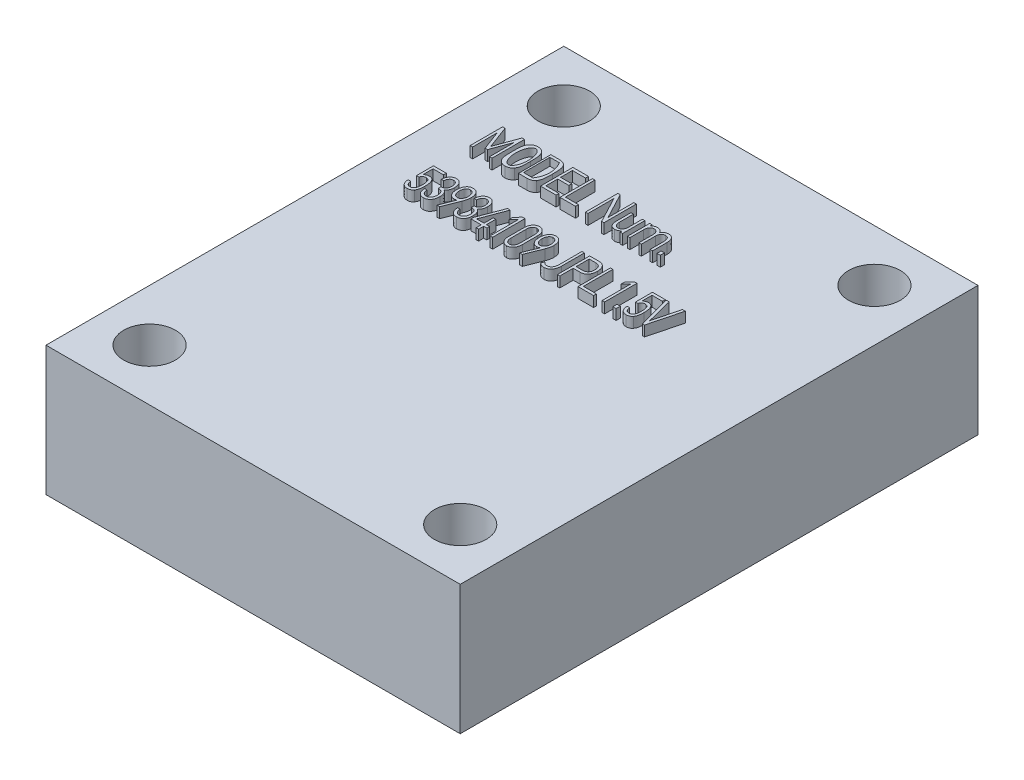
from build123d import *

# Parameters (mm, degrees)
SKETCH1_W           = 40.64
SKETCH1_H           = 50.8
BOSS_EXTRUDE1_DEPTH = 12.7
SKETCH2_R           = 2.54
CUT_EXTRUDE1_DEPTH  = 35.919226796
SKETCH3_W           = 0.325244533
SKETCH3_H           = 0.407845528
SKETCH3_H_2         = 0.407845529
BOSS_EXTRUDE2_DEPTH = 1.016
SKETCH4_RX          = 1.351043678
SKETCH4_RY          = 0.627270279
CUT_EXTRUDE2_DEPTH  = 0.762
CUT_EXTRUDE3_DEPTH  = 0.762


with BuildPart() as part:
    # Sketch1 → Boss-Extrude1 (new body)
    with BuildSketch(Plane(origin=(0, 0, 0), x_dir=(1, 0, 0), z_dir=(0, 1, 0))):
        Rectangle(SKETCH1_W, SKETCH1_H)
    extrude(amount=BOSS_EXTRUDE1_DEPTH)

    # Sketch2 → Cut-Extrude1 (cut, through all)
    with BuildSketch(Plane(origin=(0, 12.7, 0), x_dir=(1, 0, 0), z_dir=(0, 1, 0))):
        with Locations(Location((-15.24, 20.32, 0), (0, 0, 270))):
            Circle(SKETCH2_R)
        with Locations(Location((15.24, 20.32, 0), (0, 0, 270))):
            Circle(SKETCH2_R)
        with Locations(Location((15.24, -20.32, 0), (0, 0, 270))):
            Circle(SKETCH2_R)
        with Locations(Location((-15.24, -20.32, 0), (0, 0, 270))):
            Circle(SKETCH2_R)
    extrude(amount=-CUT_EXTRUDE1_DEPTH, mode=Mode.SUBTRACT)

    # Sketch3 → Boss-Extrude2 (add)
    # profile 1 of 24: a face of its own
    with BuildSketch(Plane(origin=(0, 12.7, 0), x_dir=(1, 0, 0), z_dir=(0, 1, 0))):
        Polygon((-13.314111838, 11.35951732), (-13.314111838, 14.53451732), (-13.556755374, 14.53451732), (-14.374432193, 12.282592004), (-15.213949866, 14.53451732), (-15.456592773, 14.53451732), (-15.456592773, 11.35951732), (-15.213949866, 11.35951732), (-15.213949866, 13.771997531), (-14.497464955, 11.858958695), (-14.262255262, 11.858958695), (-13.556755374, 13.771997531), (-13.556755374, 11.35951732), align=None)
    # profile 2 of 24: a face of its own
    with BuildSketch(Plane(origin=(0, 12.7, 0), x_dir=(1, 0, 0), z_dir=(0, 1, 0))):
        with BuildLine():
            add(Edge.make_bspline(
                [(-11.154079947, 12.947099877), (-11.153481949, 12.988157698), (-11.152316906, 13.068148055), (-11.153408668, 13.18493148), (-11.154476227, 13.295287702), (-11.156733197, 13.399005541), (-11.161679349, 13.495993437), (-11.166486119, 13.586381336), (-11.173046778, 13.670284731), (-11.182646091, 13.772277864), (-11.202566703, 13.891419401), (-11.241215507, 14.026053518), (-11.295874564, 14.151040405), (-11.344299029, 14.226621385), (-11.368328545, 14.26412669)],
                knots=[0, 0, 0, 0, 1.089770281, 2.123130504, 3.099450874, 4.018897256, 4.876192039, 5.676767862, 6.421141524, 7.109648699, 8.39549899, 9.620440433, 10.819198828, 12, 12, 12, 12], degree=3))
            add(Edge.make_bspline(
                [(-11.368328545, 14.26412669), (-11.390212713, 14.288692167), (-11.433096128, 14.336829778), (-11.504724911, 14.399877272), (-11.580675067, 14.452968445), (-11.660315048, 14.497306005), (-11.74415063, 14.531711097), (-11.83204871, 14.556358694), (-11.924094053, 14.571364943), (-11.986925162, 14.573891191), (-12.01881635, 14.575173438)],
                knots=[0, 0, 0, 0, 1.058857745, 2.074898921, 3.064715255, 4.038398576, 5.004585157, 5.976195968, 6.972777713, 8, 8, 8, 8], degree=3))
            add(Edge.make_bspline(
                [(-12.01881635, 14.575173438), (-12.05070684, 14.573889271), (-12.113536574, 14.57135924), (-12.205591913, 14.556380485), (-12.293645209, 14.531577697), (-12.37779138, 14.497441104), (-12.457546542, 14.45317706), (-12.532997747, 14.399449269), (-12.605190175, 14.337088018), (-12.648104403, 14.288738533), (-12.66994948, 14.26412669)],
                knots=[0, 0, 0, 0, 1.026458486, 2.022299212, 2.993187573, 3.96506266, 4.938021988, 5.921441307, 6.941929579, 8, 8, 8, 8], degree=3))
            add(Edge.make_bspline(
                [(-12.66994948, 14.26412669), (-12.694057187, 14.226653354), (-12.742592271, 14.151209781), (-12.796056224, 14.025765272), (-12.83599201, 13.89157271), (-12.855586765, 13.772264896), (-12.865250927, 13.670287963), (-12.871740998, 13.586378307), (-12.876800417, 13.496012204), (-12.880709469, 13.398985874), (-12.882958919, 13.295284483), (-12.885315765, 13.184938538), (-12.885018422, 13.068118762), (-12.884049579, 12.988102609), (-12.883552122, 12.947017951)],
                knots=[0, 0, 0, 0, 1.180815503, 2.3772887, 3.603853778, 4.889719675, 5.578235206, 6.322617903, 7.123203442, 7.980261466, 8.899719008, 9.876134685, 10.909491679, 12, 12, 12, 12], degree=3))
            add(Edge.make_bspline(
                [(-12.883552122, 12.947017951), (-12.884049579, 12.905933292), (-12.88501842, 12.82591714), (-12.88531577, 12.709097362), (-12.882958902, 12.598751423), (-12.880709528, 12.49505001), (-12.876800217, 12.398023755), (-12.871741669, 12.307657399), (-12.865248685, 12.223748591), (-12.855597254, 12.121767953), (-12.83588128, 12.002281587), (-12.796192404, 11.867799788), (-12.742578908, 11.742184711), (-12.694052752, 11.666738522), (-12.66994948, 11.629263886)],
                knots=[0, 0, 0, 0, 1.09001098, 2.122896697, 3.098867066, 4.017905277, 4.874572428, 5.674792849, 6.41883606, 7.107037584, 8.392317045, 9.623795495, 10.819723024, 12, 12, 12, 12], degree=3))
            add(Edge.make_bspline(
                [(-12.66994948, 11.629263886), (-12.648104403, 11.604652043), (-12.605190175, 11.556302558), (-12.532997747, 11.493941308), (-12.457546542, 11.440213516), (-12.37779138, 11.395949472), (-12.293645209, 11.361812879), (-12.205591913, 11.337010091), (-12.113536574, 11.322031336), (-12.05070684, 11.319501305), (-12.01881635, 11.318217138)],
                knots=[0, 0, 0, 0, 1.058070421, 2.078558693, 3.061978012, 4.03493734, 5.006812427, 5.977700788, 6.973541514, 8, 8, 8, 8], degree=3))
            add(Edge.make_bspline(
                [(-12.01881635, 11.318217138), (-11.986925162, 11.319499385), (-11.924094053, 11.322025633), (-11.83204871, 11.337031882), (-11.74415063, 11.361679479), (-11.660315048, 11.396084571), (-11.580675067, 11.440422131), (-11.504724911, 11.493513304), (-11.433096128, 11.556560798), (-11.390212713, 11.604698409), (-11.368328545, 11.629263886)],
                knots=[0, 0, 0, 0, 1.027222287, 2.023804032, 2.995414843, 3.961601424, 4.935284745, 5.925101079, 6.941142255, 8, 8, 8, 8], degree=3))
            add(Edge.make_bspline(
                [(-11.368328545, 11.629263886), (-11.344303342, 11.666770426), (-11.295887568, 11.742353893), (-11.241078849, 11.867511837), (-11.2026768, 12.002434113), (-11.182635767, 12.121755077), (-11.173048985, 12.223751803), (-11.166485458, 12.307654376), (-11.161679547, 12.398042521), (-11.156733135, 12.495030343), (-11.154476258, 12.598748204), (-11.153408607, 12.709104421), (-11.15231688, 12.825915155), (-11.153482228, 12.905932821), (-11.154079947, 12.947099877)],
                knots=[0, 0, 0, 0, 1.180190703, 2.378329345, 3.608117018, 4.89330253, 5.581453749, 6.325442573, 7.125604501, 7.982456066, 8.901427099, 9.877242715, 10.910068696, 12, 12, 12, 12], degree=3))
        make_face()
    # profile 3 of 24: a face of its own
    with BuildSketch(Plane(origin=(0, 12.7, 0), x_dir=(1, 0, 0), z_dir=(0, 1, 0))):
        with BuildLine():
            add(Edge.make_bspline(
                [(-8.994047427, 12.983186412), (-8.993410104, 13.096990146), (-8.992138982, 13.323968202), (-9.007905224, 13.57859923), (-9.025935167, 13.746074336), (-9.040267435, 13.826881077), (-9.059006829, 13.905325936), (-9.082212146, 13.981132322), (-9.109262484, 14.054541814), (-9.141203991, 14.12512449), (-9.17690513, 14.193421256), (-9.20433826, 14.2367694), (-9.217975903, 14.258318764)],
                knots=[0, 0, 0, 0, 2.595443754, 5.176532941, 5.813758949, 6.43652042, 7.04704194, 7.652375527, 8.243889601, 8.830273395, 9.418501877, 10, 10, 10, 10], degree=3))
            add(Edge.make_bspline(
                [(-9.217975903, 14.258318764), (-9.238368147, 14.280105201), (-9.278729465, 14.323225974), (-9.347314434, 14.379012739), (-9.421194786, 14.426310312), (-9.500444338, 14.465230748), (-9.585058473, 14.495712181), (-9.675021577, 14.517644761), (-9.770657027, 14.530472494), (-9.836159094, 14.532719937), (-9.869754358, 14.533872625)],
                knots=[0, 0, 0, 0, 0.979902486, 1.939470535, 2.896534949, 3.857742463, 4.835065549, 5.846766928, 6.895631298, 8, 8, 8, 8], degree=3))
            Line((-9.869754358, 14.533872625), (-10.723519602, 14.53451732))
            Line((-10.723519602, 14.53451732), (-10.723519602, 11.359517951))
            Line((-10.723519602, 11.359517951), (-9.869668021, 11.359517951))
            add(Edge.make_bspline(
                [(-9.869668021, 11.359517951), (-9.836101604, 11.360671748), (-9.77062849, 11.362922292), (-9.675021575, 11.375745719), (-9.585058473, 11.397678419), (-9.500444338, 11.428159821), (-9.421194786, 11.467080266), (-9.347314434, 11.514377837), (-9.278729465, 11.570164602), (-9.238368147, 11.613285375), (-9.217975903, 11.635071812)],
                knots=[0, 0, 0, 0, 1.103554365, 2.1525426, 3.164363456, 4.141801958, 5.103122985, 6.060300424, 7.019981793, 8, 8, 8, 8], degree=3))
            add(Edge.make_bspline(
                [(-9.217975903, 11.635071812), (-9.204345487, 11.657274814), (-9.17691969, 11.701949533), (-9.140909028, 11.772463262), (-9.109016905, 11.846338284), (-9.082262555, 11.923932189), (-9.058807045, 12.004615694), (-9.040231497, 12.088697579), (-9.0258669, 12.176157178), (-9.013914786, 12.296777774), (-9.003904766, 12.448496358), (-8.995105501, 12.629214132), (-8.991857285, 12.807191608), (-8.993322297, 12.924862528), (-8.994047427, 12.983186412)],
                knots=[0, 0, 0, 0, 0.676178479, 1.360540578, 2.053507356, 2.76352441, 3.48997716, 4.233823803, 4.997694142, 5.789570174, 7.379532901, 8.944913591, 10.486524215, 12, 12, 12, 12], degree=3))
        make_face()
    # profile 4 of 24: a face of its own
    with BuildSketch(Plane(origin=(0, 12.7, 0), x_dir=(1, 0, 0), z_dir=(0, 1, 0))):
        Polygon((-7.033106555, 11.359517951), (-7.033106555, 11.64346104), (-8.320844175, 11.64346104), (-8.320844175, 12.805045776), (-7.22310063, 12.805045776), (-7.22310063, 13.088989495), (-8.320844175, 13.088989495), (-8.320844175, 14.250573601), (-7.033106555, 14.250573601), (-7.033106555, 14.53451732), (-8.563487082, 14.53451732), (-8.563487082, 11.359517951), align=None)
    # profile 5 of 24: a face of its own
    with BuildSketch(Plane(origin=(0, 12.7, 0), x_dir=(1, 0, 0), z_dir=(0, 1, 0))):
        Polygon((-5.12791573, 11.359517951), (-5.12791573, 11.64346104), (-6.408616533, 11.64346104), (-6.408616533, 14.53451732), (-6.651259439, 14.53451732), (-6.651259439, 11.359517951), align=None)
    # profile 6 of 24: a face of its own
    with BuildSketch(Plane(origin=(0, 12.7, 0), x_dir=(1, 0, 0), z_dir=(0, 1, 0))):
        Polygon((-2.33635637, 11.35951732), (-2.33635637, 14.53451732), (-2.578999277, 14.53451732), (-2.578999277, 11.997196932), (-3.918563317, 14.53451732), (-4.148430171, 14.53451732), (-4.148430171, 11.35951732), (-3.905787265, 11.35951732), (-3.905787265, 13.905776471), (-2.566228896, 11.35951732), align=None)
    # profile 7 of 24: a face of its own
    with BuildSketch(Plane(origin=(0, 12.7, 0), x_dir=(1, 0, 0), z_dir=(0, 1, 0))):
        with BuildLine():
            Line((-0.506730354, 11.35951732), (-0.506730354, 13.543298438))
            Line((-0.506730354, 13.543298438), (-0.749373261, 13.543298438))
            Line((-0.749373261, 13.543298438), (-0.749373261, 12.19839408))
            add(Edge.make_bspline(
                [(-0.749373261, 12.19839408), (-0.749914866, 12.174085476), (-0.750962018, 12.127086733), (-0.757682303, 12.059035923), (-0.767191465, 11.995884215), (-0.779814648, 11.937008409), (-0.797268506, 11.883122917), (-0.81798323, 11.833676846), (-0.841758042, 11.788653356), (-0.8697061, 11.74854782), (-0.900553089, 11.712941324), (-0.934484342, 11.682333239), (-0.970849186, 11.656346425), (-1.009694219, 11.634769114), (-1.051658746, 11.618564773), (-1.096078592, 11.607180525), (-1.142995871, 11.599808585), (-1.175044779, 11.598802409), (-1.191421025, 11.598288276)],
                knots=[0, 0, 0, 0, 1.386912367, 2.681484174, 3.89831668, 5.029897552, 6.112840166, 7.124956867, 8.085919217, 9.011995425, 9.907976827, 10.768276023, 11.612936128, 12.453394584, 13.296716012, 14.17194484, 15.065906367, 16, 16, 16, 16], degree=3))
            add(Edge.make_bspline(
                [(-1.191421025, 11.598288276), (-1.207787531, 11.598868756), (-1.239573368, 11.599996121), (-1.286181248, 11.606335446), (-1.329921979, 11.617928019), (-1.371044287, 11.634246477), (-1.409318156, 11.654841488), (-1.444761685, 11.680593686), (-1.477329729, 11.710802453), (-1.507619452, 11.745348405), (-1.53368502, 11.784907325), (-1.557327543, 11.828620121), (-1.577024307, 11.876896995), (-1.593438165, 11.929760203), (-1.605054035, 11.987369497), (-1.615025234, 12.049090356), (-1.62082865, 12.115514516), (-1.621503413, 12.161215903), (-1.621852935, 12.184888886)],
                knots=[0, 0, 0, 0, 0.954836527, 1.854413955, 2.73694419, 3.587318718, 4.429415767, 5.265133201, 6.1352695, 7.015746194, 7.937875953, 8.892135315, 9.910317774, 10.973868857, 12.115648671, 13.334704924, 14.619396763, 16, 16, 16, 16], degree=3))
            Line((-1.621852935, 12.184888886), (-1.621852305, 13.543298438))
            Line((-1.621852305, 13.543298438), (-1.864495212, 13.543298438))
            Line((-1.864495212, 13.543298438), (-1.864495212, 12.136228592))
            add(Edge.make_bspline(
                [(-1.864495212, 12.136228592), (-1.864244349, 12.10467916), (-1.863754927, 12.043127751), (-1.856467826, 11.953564913), (-1.844739842, 11.868842496), (-1.825642495, 11.78936456), (-1.80201981, 11.714379195), (-1.772954692, 11.644273777), (-1.73833679, 11.579086779), (-1.710066033, 11.539706474), (-1.696065334, 11.520203926)],
                knots=[0, 0, 0, 0, 1.164019748, 2.270945921, 3.313938367, 4.317168677, 5.283765888, 6.212591214, 7.114810704, 8, 8, 8, 8], degree=3))
            add(Edge.make_bspline(
                [(-1.696065334, 11.520203926), (-1.682461226, 11.504557714), (-1.655428859, 11.473467536), (-1.608385029, 11.433655068), (-1.558013732, 11.398984819), (-1.503172203, 11.371305646), (-1.444676584, 11.348923222), (-1.381735086, 11.333895276), (-1.314774812, 11.323894695), (-1.268682735, 11.322276045), (-1.244983017, 11.321443764)],
                knots=[0, 0, 0, 0, 0.974380957, 1.936166877, 2.890734689, 3.84594632, 4.819801352, 5.831279895, 6.884883033, 8, 8, 8, 8], degree=3))
            add(Edge.make_bspline(
                [(-1.244983017, 11.321443764), (-1.220184359, 11.322317286), (-1.1713209, 11.324038482), (-1.100090916, 11.337478298), (-1.032141619, 11.35803908), (-0.967741646, 11.387404853), (-0.906831859, 11.425210246), (-0.849233571, 11.470826617), (-0.794321956, 11.523761933), (-0.762449579, 11.564529087), (-0.746146635, 11.585381772)],
                knots=[0, 0, 0, 0, 1.014459015, 1.998897551, 2.956994486, 3.91452481, 4.88707834, 5.884076943, 6.917690526, 8, 8, 8, 8], degree=3))
            Line((-0.746146635, 11.585381772), (-0.746002949, 11.35951732))
            Line((-0.746002949, 11.35951732), (-0.506730354, 11.35951732))
        make_face()
    # profile 8 of 24: a face of its own
    with BuildSketch(Plane(origin=(0, 12.7, 0), x_dir=(1, 0, 0), z_dir=(0, 1, 0))):
        with BuildLine():
            Line((2.438018244, 11.35951732), (2.438018244, 12.771144146))
            add(Edge.make_bspline(
                [(2.438018244, 12.771144146), (2.437310629, 12.802251472), (2.435924808, 12.863173252), (2.427682493, 12.952174976), (2.413421368, 13.036247865), (2.394201994, 13.115533459), (2.369193766, 13.189947767), (2.337974631, 13.259126705), (2.302133382, 13.323635791), (2.273446614, 13.362667283), (2.259261902, 13.381967138)],
                knots=[0, 0, 0, 0, 1.151888295, 2.255902212, 3.306053365, 4.306710952, 5.273906016, 6.20796796, 7.113896092, 8, 8, 8, 8], degree=3))
            add(Edge.make_bspline(
                [(2.259261902, 13.381967138), (2.24565058, 13.397392017), (2.218593019, 13.428054698), (2.171613298, 13.467350986), (2.120816996, 13.500977592), (2.066736235, 13.529976151), (2.007591117, 13.550903065), (1.945012801, 13.567118425), (1.878203618, 13.577576726), (1.832308716, 13.579660871), (1.80882491, 13.5807273)],
                knots=[0, 0, 0, 0, 0.969856343, 1.927949935, 2.879728672, 3.842491076, 4.815742616, 5.832759171, 6.891051965, 8, 8, 8, 8], degree=3))
            add(Edge.make_bspline(
                [(1.80882491, 13.5807273), (1.77841769, 13.579613626), (1.719056108, 13.577439488), (1.632676718, 13.560341562), (1.552256534, 13.531646039), (1.47674195, 13.492620967), (1.407353623, 13.441455854), (1.342926975, 13.37962257), (1.284661411, 13.30624627), (1.251929995, 13.251377952), (1.235130804, 13.223217138)],
                knots=[0, 0, 0, 0, 1.024270552, 1.999601373, 2.953464987, 3.893816435, 4.853749116, 5.848448132, 6.895729749, 8, 8, 8, 8], degree=3))
            add(Edge.make_bspline(
                [(1.235130804, 13.223217138), (1.221386875, 13.251333923), (1.194714131, 13.305899968), (1.144862031, 13.379329362), (1.088144792, 13.441495912), (1.024994169, 13.492948813), (0.953915506, 13.531846667), (0.876813857, 13.560411417), (0.792748137, 13.577525294), (0.734654254, 13.579637332), (0.704673487, 13.5807273)],
                knots=[0, 0, 0, 0, 1.101519222, 2.137710445, 3.113863403, 4.057077085, 4.993294058, 5.954717714, 6.944482151, 8, 8, 8, 8], degree=3))
            add(Edge.make_bspline(
                [(0.704673487, 13.5807273), (0.679885709, 13.580060567), (0.631281557, 13.57875323), (0.560115297, 13.566151475), (0.492802753, 13.545086829), (0.427934773, 13.517569415), (0.367329174, 13.480285726), (0.309971676, 13.435252922), (0.256162768, 13.382095486), (0.224147523, 13.341876749), (0.207773081, 13.321306569)],
                knots=[0, 0, 0, 0, 1.020068766, 2.000162245, 2.964029361, 3.920131467, 4.893919963, 5.884485377, 6.918003829, 8, 8, 8, 8], degree=3))
            Line((0.207773081, 13.321306569), (0.207773711, 13.543298438))
            Line((0.207773711, 13.543298438), (-0.034869196, 13.543298438))
            Line((-0.034869196, 13.543298438), (-0.034869196, 11.35951732))
            Line((-0.034869196, 11.35951732), (0.207773711, 11.35951732))
            Line((0.207773711, 11.35951732), (0.207773711, 12.704383237))
            add(Edge.make_bspline(
                [(0.207773711, 12.704383237), (0.208394444, 12.728483779), (0.209598937, 12.775249354), (0.215291291, 12.843157511), (0.224810818, 12.906591992), (0.238383107, 12.965213766), (0.254947092, 13.019351415), (0.275780058, 13.068483396), (0.2995099, 13.113511671), (0.327432866, 13.153655803), (0.35831053, 13.188991737), (0.39161618, 13.220045562), (0.427980486, 13.245809047), (0.466645226, 13.267253103), (0.508101409, 13.283620986), (0.552095196, 13.29506438), (0.59881651, 13.302351409), (0.630864015, 13.303364912), (0.647239544, 13.303882788)],
                knots=[0, 0, 0, 0, 1.379329741, 2.67650195, 3.896821219, 5.04636851, 6.116958719, 7.131975583, 8.095691514, 9.02442134, 9.922970126, 10.77664272, 11.623723149, 12.466589891, 13.300874625, 14.166706653, 15.063229776, 16, 16, 16, 16], degree=3))
            add(Edge.make_bspline(
                [(0.647239544, 13.303882788), (0.663605822, 13.303302011), (0.695391213, 13.302174067), (0.742002262, 13.295838859), (0.785731467, 13.284231308), (0.826895052, 13.267966491), (0.865171713, 13.247091269), (0.901181298, 13.222040305), (0.933132698, 13.190916068), (0.964103127, 13.156905638), (0.990843317, 13.117433497), (1.014437568, 13.073544179), (1.034026824, 13.025168507), (1.051163121, 12.972447809), (1.063820361, 12.914942792), (1.072526801, 12.853003719), (1.078505872, 12.78665748), (1.079656603, 12.740957651), (1.080252756, 12.717282178)],
                knots=[0, 0, 0, 0, 0.953565418, 1.8519453, 2.733300683, 3.582543165, 4.423519188, 5.268313403, 6.128119581, 7.015687394, 7.943637299, 8.89662632, 9.913453342, 10.979350986, 12.12229242, 13.337854588, 14.620836204, 16, 16, 16, 16], degree=3))
            Line((1.080252756, 12.717282178), (1.080252756, 11.35951732))
            Line((1.080252756, 11.35951732), (1.322895662, 11.35951732))
            Line((1.322895662, 11.35951732), (1.322895662, 12.753218726))
            add(Edge.make_bspline(
                [(1.322895662, 12.753218726), (1.323455614, 12.774384878), (1.32455353, 12.815886104), (1.331201813, 12.876070845), (1.340699165, 12.932848399), (1.354098764, 12.98581129), (1.371659899, 13.034944015), (1.392180288, 13.08052033), (1.416767214, 13.122158071), (1.445377777, 13.159401493), (1.476163774, 13.19326722), (1.510191156, 13.222357654), (1.546103824, 13.248004405), (1.585373617, 13.267599002), (1.625929228, 13.28431013), (1.669455737, 13.294938767), (1.714999784, 13.302361474), (1.746412057, 13.303370473), (1.762361496, 13.303882788)],
                knots=[0, 0, 0, 0, 1.282099672, 2.513858366, 3.664219651, 4.767185724, 5.818125203, 6.821034324, 7.79089408, 8.739513456, 9.661630855, 10.557694203, 11.446910012, 12.32691289, 13.210093553, 14.098162972, 15.034350943, 16, 16, 16, 16], degree=3))
            add(Edge.make_bspline(
                [(1.762361496, 13.303882788), (1.778727773, 13.303302011), (1.810513165, 13.302174067), (1.857124213, 13.295838859), (1.900853418, 13.284231308), (1.942017003, 13.267966491), (1.980293665, 13.247091269), (2.016303249, 13.222040305), (2.048254649, 13.190916068), (2.079225078, 13.156905638), (2.105965268, 13.117433497), (2.129559519, 13.073544179), (2.149148776, 13.025168507), (2.166285072, 12.972447809), (2.178942312, 12.914942792), (2.187648752, 12.853003719), (2.193627824, 12.78665748), (2.194778554, 12.740957651), (2.195374707, 12.717282178)],
                knots=[0, 0, 0, 0, 0.953565418, 1.8519453, 2.733300683, 3.582543165, 4.423519188, 5.268313403, 6.128119581, 7.015687394, 7.943637299, 8.89662632, 9.913453342, 10.979350986, 12.12229242, 13.337854588, 14.620836204, 16, 16, 16, 16], degree=3))
            Line((2.195374707, 12.717282178), (2.195375337, 11.35951732))
            Line((2.195375337, 11.35951732), (2.438018244, 11.35951732))
        make_face()
    # profile 9 of 24: a face of its own
    with BuildSketch(Plane(origin=(0, 12.7, 0), x_dir=(1, 0, 0), z_dir=(0, 1, 0))):
        with Locations((3.031200226, 11.563440715)):
            Rectangle(SKETCH3_W, SKETCH3_H)
    # profile 10 of 24: a face of its own
    with BuildSketch(Plane(origin=(0, 12.7, 0), x_dir=(1, 0, 0), z_dir=(0, 1, 0))):
        with BuildLine():
            add(Edge.make_bspline(
                [(-14.222730354, 5.700112433), (-14.222601086, 5.738243562), (-14.222343292, 5.814287032), (-14.228125574, 5.928311649), (-14.240327171, 6.041669096), (-14.255283576, 6.154279199), (-14.279318062, 6.26417299), (-14.314576151, 6.36898387), (-14.362060217, 6.467766279), (-14.402061768, 6.528215949), (-14.422136472, 6.558552503)],
                knots=[0, 0, 0, 0, 1.02076288, 2.035668849, 3.054537558, 4.072592149, 5.075780477, 6.061038541, 7.026935774, 8, 8, 8, 8], degree=3))
            add(Edge.make_bspline(
                [(-14.422136472, 6.558552503), (-14.434617536, 6.574219307), (-14.459264416, 6.605157198), (-14.503577626, 6.644539009), (-14.551053359, 6.679128252), (-14.603495549, 6.706672049), (-14.659214603, 6.729868296), (-14.719837494, 6.745587574), (-14.784457959, 6.756125899), (-14.829079233, 6.758191274), (-14.851923057, 6.759248642)],
                knots=[0, 0, 0, 0, 0.975842087, 1.927036128, 2.882564967, 3.836015562, 4.810727679, 5.821680964, 6.884811393, 8, 8, 8, 8], degree=3))
            add(Edge.make_bspline(
                [(-14.851923057, 6.759248642), (-14.876056143, 6.758232045), (-14.923063979, 6.756251858), (-14.991044393, 6.745226932), (-15.054398594, 6.727589538), (-15.11353735, 6.704132934), (-15.167290473, 6.672489179), (-15.217132341, 6.635566306), (-15.261797884, 6.59142384), (-15.28746204, 6.558006571), (-15.300424074, 6.541128723)],
                knots=[0, 0, 0, 0, 1.116431972, 2.17465145, 3.176365596, 4.153673296, 5.107558898, 6.052688289, 7.016483584, 8, 8, 8, 8], degree=3))
            Line((-15.300424074, 6.541128723), (-15.300423443, 7.55475564))
            Line((-15.300423443, 7.55475564), (-14.273265493, 7.55475564))
            Line((-14.273265493, 7.55475564), (-14.273265493, 7.83131026))
            Line((-14.273265493, 7.83131026), (-15.535322448, 7.83131026))
            Line((-15.535322448, 7.83131026), (-15.535322448, 6.163704228))
            Line((-15.535322448, 6.163704228), (-15.300423443, 6.163704228))
            add(Edge.make_bspline(
                [(-15.300423443, 6.163704228), (-15.293337123, 6.186506474), (-15.279418505, 6.231293583), (-15.247729159, 6.29303085), (-15.206629661, 6.346874852), (-15.158268384, 6.393868096), (-15.10109268, 6.431741438), (-15.035622269, 6.458047548), (-14.963594253, 6.475413151), (-14.912904755, 6.477471136), (-14.886770618, 6.478532178)],
                knots=[0, 0, 0, 0, 1.01664333, 1.996843397, 2.939522804, 3.892890377, 4.859354092, 5.841953253, 6.887369337, 8, 8, 8, 8], degree=3))
            add(Edge.make_bspline(
                [(-14.886770618, 6.478532178), (-14.865609085, 6.476968843), (-14.824803691, 6.473954292), (-14.766877858, 6.460060674), (-14.714638763, 6.440136649), (-14.667642913, 6.413376991), (-14.62688193, 6.378759777), (-14.591663223, 6.337559911), (-14.56215077, 6.289708999), (-14.531828712, 6.215647525), (-14.503016865, 6.114265591), (-14.478529908, 5.9844452), (-14.464669441, 5.845127348), (-14.465133797, 5.749129662), (-14.465373261, 5.699624658)],
                knots=[0, 0, 0, 0, 0.765728025, 1.476539172, 2.143449675, 2.780756255, 3.420711983, 4.06569922, 4.732292546, 5.442678541, 6.950376392, 8.532826335, 10.212014778, 12, 12, 12, 12], degree=3))
            add(Edge.make_bspline(
                [(-14.465373261, 5.699624658), (-14.46560298, 5.641304242), (-14.466063434, 5.524405584), (-14.479334278, 5.379202142), (-14.499451191, 5.266282995), (-14.524210398, 5.187021043), (-14.558246606, 5.113552119), (-14.58803277, 5.0692204), (-14.602827529, 5.047200877)],
                knots=[0, 0, 0, 0, 1.546672813, 3.100183233, 3.861200304, 4.584912326, 5.297127306, 6, 6, 6, 6], degree=3))
            add(Edge.make_bspline(
                [(-14.602827529, 5.047200877), (-14.612678698, 5.035558365), (-14.63208101, 5.012627923), (-14.665329118, 4.982789229), (-14.700828476, 4.957841115), (-14.738172315, 4.936382184), (-14.778360427, 4.92079397), (-14.820502159, 4.907937105), (-14.865272988, 4.901220772), (-14.895788129, 4.899599735), (-14.911292976, 4.898776081)],
                knots=[0, 0, 0, 0, 1.032384994, 2.03332787, 3.015960249, 3.968630933, 4.942905874, 5.929851848, 6.948150673, 8, 8, 8, 8], degree=3))
            add(Edge.make_bspline(
                [(-14.911292976, 4.898776081), (-14.941829912, 4.900714108), (-15.000361007, 4.904428786), (-15.082389743, 4.93055542), (-15.153905564, 4.971007349), (-15.213955167, 5.027580807), (-15.262444079, 5.099240157), (-15.298520654, 5.186041898), (-15.325209425, 5.287004734), (-15.333059804, 5.359797294), (-15.33720761, 5.398257788)],
                knots=[0, 0, 0, 0, 0.999017347, 1.914847615, 2.792228335, 3.669552477, 4.591944629, 5.604950454, 6.734557629, 8, 8, 8, 8], degree=3))
            Line((-15.33720761, 5.398257788), (-15.595135397, 5.398552722))
            add(Edge.make_bspline(
                [(-15.595135397, 5.398552722), (-15.593420263, 5.370456893), (-15.590064155, 5.315480049), (-15.578933912, 5.235414587), (-15.563487677, 5.159519693), (-15.543650318, 5.087839161), (-15.518972748, 5.020328643), (-15.489983462, 4.956693548), (-15.455939735, 4.897330056), (-15.429588333, 4.860707725), (-15.41658261, 4.842632788)],
                knots=[0, 0, 0, 0, 1.138934757, 2.228624028, 3.268480413, 4.27186913, 5.23588173, 6.174758644, 7.09915288, 8, 8, 8, 8], degree=3))
            add(Edge.make_bspline(
                [(-15.41658261, 4.842632788), (-15.401729067, 4.825654302), (-15.37218536, 4.791884084), (-15.320571369, 4.748755963), (-15.264493986, 4.711575475), (-15.203524113, 4.68039744), (-15.137403837, 4.65600875), (-15.066478929, 4.637903063), (-14.990583034, 4.626331726), (-14.938220554, 4.623425899), (-14.911292976, 4.621931569)],
                knots=[0, 0, 0, 0, 0.9498605, 1.889273088, 2.824957399, 3.782149508, 4.769290159, 5.789898496, 6.863447999, 8, 8, 8, 8], degree=3))
            add(Edge.make_bspline(
                [(-14.911292976, 4.621931569), (-14.884782826, 4.623099289), (-14.832991498, 4.625380596), (-14.758018051, 4.637996125), (-14.687874198, 4.656495625), (-14.622919228, 4.68178771), (-14.562790597, 4.713386511), (-14.508429758, 4.752810688), (-14.457839788, 4.797835748), (-14.42941066, 4.833162204), (-14.415037895, 4.851022016)],
                knots=[0, 0, 0, 0, 1.123227566, 2.194383907, 3.213415932, 4.19153353, 5.141396265, 6.08207882, 7.030366616, 8, 8, 8, 8], degree=3))
            add(Edge.make_bspline(
                [(-14.415037895, 4.851022016), (-14.39536267, 4.880264082), (-14.356062965, 4.938672795), (-14.310468488, 5.034305905), (-14.276070186, 5.135324404), (-14.252622553, 5.24151313), (-14.238073508, 5.351727472), (-14.227536697, 5.464966351), (-14.222449302, 5.581266539), (-14.222636267, 5.659825958), (-14.222730354, 5.700112433)],
                knots=[0, 0, 0, 0, 0.954041913, 1.905623252, 2.860483948, 3.84047431, 4.84701024, 5.87134754, 6.921611165, 8, 8, 8, 8], degree=3))
        make_face()
    # profile 11 of 24: a face of its own
    with BuildSketch(Plane(origin=(0, 12.7, 0), x_dir=(1, 0, 0), z_dir=(0, 1, 0))):
        with BuildLine():
            add(Edge.make_bspline(
                [(-12.599608403, 5.519115729), (-12.600612213, 5.56729811), (-12.602534153, 5.659550222), (-12.620062486, 5.791425521), (-12.648473658, 5.910318825), (-12.6891536, 6.016234399), (-12.741661074, 6.109251975), (-12.806204498, 6.189023701), (-12.882539556, 6.256089999), (-12.941575013, 6.288145304), (-12.97131635, 6.304294373)],
                knots=[0, 0, 0, 0, 1.258709654, 2.409981041, 3.469414411, 4.446585881, 5.365622275, 6.24888605, 7.117810321, 8, 8, 8, 8], degree=3))
            add(Edge.make_bspline(
                [(-12.97131635, 6.304294373), (-12.945178603, 6.321865795), (-12.893377344, 6.356689829), (-12.825328765, 6.421418281), (-12.768992382, 6.496901984), (-12.72192166, 6.581353538), (-12.686778138, 6.676391695), (-12.660978424, 6.780448703), (-12.646368366, 6.894570218), (-12.644475383, 6.973670204), (-12.643491147, 7.014797422)],
                knots=[0, 0, 0, 0, 0.920265328, 1.823833687, 2.73127239, 3.666435029, 4.642336155, 5.686287802, 6.797009323, 8, 8, 8, 8], degree=3))
            add(Edge.make_bspline(
                [(-12.643491147, 7.014797422), (-12.644329524, 7.04687618), (-12.645970688, 7.109671838), (-12.655974069, 7.201038937), (-12.670415395, 7.287414819), (-12.691250285, 7.368257809), (-12.716881625, 7.444184659), (-12.748332574, 7.514830239), (-12.786384011, 7.579705884), (-12.828474734, 7.639878453), (-12.876294144, 7.693409444), (-12.928349909, 7.740193738), (-12.983688691, 7.780483305), (-13.043597367, 7.813257036), (-13.107312637, 7.838899679), (-13.175047261, 7.857681096), (-13.246461711, 7.86956078), (-13.2954383, 7.871463445), (-13.320437285, 7.872434617)],
                knots=[0, 0, 0, 0, 1.255880198, 2.458443863, 3.595182086, 4.681868385, 5.723225419, 6.729704214, 7.703299243, 8.663728305, 9.600226997, 10.50666768, 11.39954804, 12.274007414, 13.173259777, 14.082552076, 15.021282376, 16, 16, 16, 16], degree=3))
            add(Edge.make_bspline(
                [(-13.320437285, 7.872434617), (-13.343922782, 7.871625088), (-13.390045825, 7.870035257), (-13.457528494, 7.859461663), (-13.521962499, 7.842599464), (-13.583314744, 7.819507096), (-13.641607816, 7.7894421), (-13.696269716, 7.752195822), (-13.748902622, 7.709834539), (-13.797416625, 7.66032725), (-13.841754227, 7.605011709), (-13.881484739, 7.543909597), (-13.915477877, 7.47687389), (-13.945549741, 7.404585333), (-13.968856774, 7.325900276), (-13.988514439, 7.242176535), (-14.001775738, 7.152557094), (-14.006972939, 7.090979382), (-14.009644602, 7.059324861)],
                knots=[0, 0, 0, 0, 0.950005533, 1.865710781, 2.756471664, 3.640576068, 4.5124318, 5.403065142, 6.312338194, 7.241548757, 8.201072826, 9.176254681, 10.184315091, 11.237997307, 12.339126637, 13.500181298, 14.714947975, 16, 16, 16, 16], degree=3))
            Line((-14.009644602, 7.059324861), (-13.765961235, 7.059967666))
            add(Edge.make_bspline(
                [(-13.765961235, 7.059967666), (-13.762043566, 7.099306778), (-13.754547489, 7.174578341), (-13.726146423, 7.279999764), (-13.687690326, 7.373162794), (-13.64312846, 7.43921861), (-13.603407319, 7.485121023), (-13.570281189, 7.513889182), (-13.535134008, 7.539147849), (-13.496808731, 7.55871092), (-13.456591065, 7.575292175), (-13.413451815, 7.586848723), (-13.367784649, 7.594012853), (-13.336381891, 7.595058953), (-13.320437285, 7.595590105)],
                knots=[0, 0, 0, 0, 1.833146202, 3.507546843, 5.051460273, 6.492221424, 7.185781109, 7.865239923, 8.524874734, 9.190683638, 9.858512985, 10.541926005, 11.259669594, 12, 12, 12, 12], degree=3))
            add(Edge.make_bspline(
                [(-13.320437285, 7.595590105), (-13.305351535, 7.595064204), (-13.27565709, 7.594029034), (-13.232143191, 7.58673359), (-13.190603399, 7.575074688), (-13.15073372, 7.559022786), (-13.113526881, 7.537236434), (-13.077383122, 7.512339637), (-13.04464796, 7.481146826), (-13.012784226, 7.44680521), (-12.984673077, 7.407101883), (-12.958938926, 7.363572224), (-12.938084495, 7.315085154), (-12.920447028, 7.262441509), (-12.907328834, 7.205533115), (-12.896718424, 7.144391439), (-12.89057299, 7.078798611), (-12.888918662, 7.03352284), (-12.888069399, 7.010280146)],
                knots=[0, 0, 0, 0, 0.887991693, 1.747902543, 2.589906438, 3.424832134, 4.269973411, 5.123894387, 6.002260362, 6.925759078, 7.878327226, 8.860166052, 9.897918184, 10.979269294, 12.125078501, 13.332705126, 14.630721953, 16, 16, 16, 16], degree=3))
            add(Edge.make_bspline(
                [(-12.888069399, 7.010280146), (-12.888193532, 6.988112214), (-12.888434941, 6.945000753), (-12.893853501, 6.882303684), (-12.902111606, 6.823459262), (-12.913562722, 6.768140081), (-12.929086127, 6.716611975), (-12.947723157, 6.668627377), (-12.969712299, 6.624528239), (-12.9949157, 6.584091188), (-13.023775981, 6.547963659), (-13.056506628, 6.516455923), (-13.093007748, 6.489844539), (-13.13323053, 6.467638093), (-13.177661704, 6.45098993), (-13.225502293, 6.438879169), (-13.276948556, 6.430953306), (-13.312448779, 6.429560601), (-13.330762488, 6.428842138)],
                knots=[0, 0, 0, 0, 1.280785561, 2.490829413, 3.633670104, 4.713864832, 5.752255022, 6.740382052, 7.685576713, 8.596207237, 9.489356965, 10.351062416, 11.213933, 12.093041224, 12.998138537, 13.947982327, 14.941413518, 16, 16, 16, 16], degree=3))
            Line((-13.330762488, 6.428842138), (-13.382541013, 6.429313528))
            Line((-13.382541013, 6.429313528), (-13.382541013, 6.148298349))
            Line((-13.382541013, 6.148298349), (-13.330256437, 6.148298349))
            add(Edge.make_bspline(
                [(-13.330256437, 6.148298349), (-13.309957317, 6.147561395), (-13.270522413, 6.146129721), (-13.213675239, 6.137519901), (-13.160809825, 6.124797109), (-13.11184571, 6.106798811), (-13.067325217, 6.08278821), (-13.026956631, 6.054014486), (-12.990060325, 6.021033512), (-12.958703571, 5.981753484), (-12.930952983, 5.938419787), (-12.90698342, 5.891050979), (-12.887180364, 5.839696384), (-12.870155236, 5.784581841), (-12.857423318, 5.724971134), (-12.848563823, 5.661345504), (-12.843441408, 5.593659993), (-12.842656193, 5.547336714), (-12.842251309, 5.523450877)],
                knots=[0, 0, 0, 0, 1.079186789, 2.096525684, 3.050706943, 3.966274092, 4.861691025, 5.731169801, 6.597408318, 7.483353558, 8.393835178, 9.329817481, 10.300375773, 11.316942982, 12.393680732, 13.537164257, 14.730079295, 16, 16, 16, 16], degree=3))
            add(Edge.make_bspline(
                [(-12.842251309, 5.523450877), (-12.843039551, 5.499343169), (-12.844570074, 5.452533411), (-12.851559632, 5.384343813), (-12.86327431, 5.320335074), (-12.878567252, 5.260301934), (-12.897844692, 5.204520063), (-12.921320539, 5.15319016), (-12.948130484, 5.105624647), (-12.980090322, 5.063389878), (-13.014058321, 5.024993779), (-13.051246208, 4.991854307), (-13.090435439, 4.963616778), (-13.131698848, 4.939630334), (-13.175656836, 4.921815412), (-13.221949757, 4.908709201), (-13.27049908, 4.901030215), (-13.303633111, 4.899534596), (-13.320437285, 4.898776081)],
                knots=[0, 0, 0, 0, 1.315419673, 2.554140641, 3.73476431, 4.861694872, 5.930376495, 6.948998907, 7.937162729, 8.901637627, 9.832186725, 10.729598787, 11.612083232, 12.463443067, 13.326287122, 14.191759741, 15.082937294, 16, 16, 16, 16], degree=3))
            add(Edge.make_bspline(
                [(-13.320437285, 4.898776081), (-13.350062747, 4.899927871), (-13.408615384, 4.902204304), (-13.493562227, 4.926923291), (-13.571511421, 4.969606764), (-13.630582426, 5.017280027), (-13.6736097, 5.063737489), (-13.70147964, 5.105554692), (-13.727286224, 5.151658873), (-13.747910217, 5.2035154), (-13.766470612, 5.260063643), (-13.780067698, 5.322178514), (-13.791401055, 5.389340398), (-13.795312594, 5.436074402), (-13.79733261, 5.460209008)],
                knots=[0, 0, 0, 0, 1.292952691, 2.555429798, 3.82653461, 5.1576311, 5.856881617, 6.587511316, 7.349563599, 8.163665128, 9.023446232, 9.949961376, 10.941308924, 12, 12, 12, 12], degree=3))
            Line((-13.79733261, 5.460209008), (-14.039974887, 5.460268246))
            add(Edge.make_bspline(
                [(-14.039974887, 5.460268246), (-14.037600071, 5.425147069), (-14.033012368, 5.357299481), (-14.019459358, 5.259138475), (-14.000265888, 5.168335377), (-13.975890074, 5.084460664), (-13.945860259, 5.007931129), (-13.909144508, 4.939064979), (-13.868323535, 4.876466048), (-13.820446775, 4.822167853), (-13.769044556, 4.774253389), (-13.713606203, 4.733662936), (-13.656037669, 4.698272283), (-13.594962907, 4.669805661), (-13.53071538, 4.647746876), (-13.463229978, 4.632354954), (-13.392760945, 4.623087378), (-13.344772978, 4.622320479), (-13.320437285, 4.621931569)],
                knots=[0, 0, 0, 0, 1.359651139, 2.626593365, 3.824583616, 4.942165412, 5.997712542, 6.993986245, 7.952816473, 8.877659589, 9.783298673, 10.662549355, 11.527665863, 12.390183998, 13.260077113, 14.147069824, 15.060340673, 16, 16, 16, 16], degree=3))
            add(Edge.make_bspline(
                [(-13.320437285, 4.621931569), (-13.295025382, 4.622765346), (-13.245280266, 4.624397508), (-13.172241688, 4.634574017), (-13.103005584, 4.653073419), (-13.036776365, 4.67730279), (-12.974318686, 4.709382406), (-12.91524494, 4.748333807), (-12.859593929, 4.794566693), (-12.807144805, 4.847272207), (-12.760062938, 4.907555073), (-12.718503283, 4.974598634), (-12.682846209, 5.048510305), (-12.65423544, 5.129591964), (-12.630728613, 5.21712908), (-12.614459304, 5.311761908), (-12.603330145, 5.413068606), (-12.600872769, 5.482980519), (-12.599608403, 5.519115729)],
                knots=[0, 0, 0, 0, 0.942228476, 1.844461047, 2.726484238, 3.594516844, 4.454045798, 5.32328642, 6.212633603, 7.131800331, 8.074636066, 9.041679611, 10.051068051, 11.110531238, 12.224734812, 13.40735661, 14.666700462, 16, 16, 16, 16], degree=3))
        make_face()
    # profile 12 of 24: a face of its own
    with BuildSketch(Plane(origin=(0, 12.7, 0), x_dir=(1, 0, 0), z_dir=(0, 1, 0))):
        with BuildLine():
            add(Edge.make_bspline(
                [(-10.976486451, 6.963051668), (-10.977129756, 6.996884081), (-10.978389314, 7.063126219), (-10.987514227, 7.159757731), (-11.002214813, 7.251216419), (-11.022736481, 7.336862004), (-11.048712423, 7.417188973), (-11.080104788, 7.49207502), (-11.117587537, 7.561563627), (-11.160930061, 7.624685471), (-11.208630409, 7.682040652), (-11.261671407, 7.731971667), (-11.319708483, 7.774158921), (-11.382067626, 7.809594178), (-11.449744368, 7.836428701), (-11.521715102, 7.856623635), (-11.59839266, 7.868900198), (-11.651023503, 7.871238215), (-11.677955578, 7.872434617)],
                knots=[0, 0, 0, 0, 1.256069681, 2.459320288, 3.600365703, 4.692945427, 5.725983715, 6.731738115, 7.7038202, 8.651983527, 9.570310109, 10.468727566, 11.348961417, 12.228687824, 13.124509875, 14.044987351, 14.999587615, 16, 16, 16, 16], degree=3))
            add(Edge.make_bspline(
                [(-11.677955578, 7.872434617), (-11.704902995, 7.871089937), (-11.757621761, 7.868459261), (-11.834245341, 7.85459015), (-11.906207691, 7.833454535), (-11.973625083, 7.804278049), (-12.035595614, 7.766277607), (-12.093888603, 7.72176919), (-12.145972908, 7.668084643), (-12.19381221, 7.608035962), (-12.236274336, 7.541563206), (-12.272934559, 7.469423032), (-12.304894116, 7.392795207), (-12.329452343, 7.310611595), (-12.35078933, 7.224207871), (-12.364158706, 7.132345647), (-12.373757026, 7.035864266), (-12.37494418, 6.969865665), (-12.375552122, 6.936067747)],
                knots=[0, 0, 0, 0, 0.988665842, 1.934183292, 2.847730768, 3.734452126, 4.619276452, 5.507680661, 6.416960397, 7.354546068, 8.319607798, 9.303983849, 10.319234142, 11.359762486, 12.446600542, 13.580189819, 14.760813957, 16, 16, 16, 16], degree=3))
            add(Edge.make_bspline(
                [(-12.375552122, 6.936067747), (-12.374840403, 6.903356727), (-12.373447387, 6.839332891), (-12.365274687, 6.745709568), (-12.350674514, 6.657040044), (-12.332469607, 6.572724901), (-12.307865375, 6.49335429), (-12.278068931, 6.418698304), (-12.243361354, 6.348802935), (-12.203260976, 6.284313927), (-12.159232971, 6.225336842), (-12.109663085, 6.173938658), (-12.056054027, 6.129793829), (-11.998166177, 6.093360365), (-11.936196099, 6.064522124), (-11.869704228, 6.044158196), (-11.799189893, 6.030122885), (-11.750514659, 6.027497244), (-11.725709643, 6.026159211)],
                knots=[0, 0, 0, 0, 1.257628214, 2.4615002, 3.608921874, 4.710367066, 5.774937521, 6.799175036, 7.797685466, 8.770667092, 9.715045266, 10.621553753, 11.508848879, 12.378394753, 13.244157576, 14.128171202, 15.046111521, 16, 16, 16, 16], degree=3))
            add(Edge.make_bspline(
                [(-11.725709643, 6.026159211), (-11.700477676, 6.027014894), (-11.651177468, 6.028686796), (-11.579475834, 6.04214772), (-11.511511296, 6.062978221), (-11.469692607, 6.084062713), (-11.44886513, 6.094563682)],
                knots=[0, 0, 0, 0, 1.050305076, 2.052168945, 3.029897745, 4, 4, 4, 4], degree=3))
            Line((-11.44886513, 6.094563682), (-12.030970521, 4.660005125))
            Line((-12.030970521, 4.660005125), (-11.757920445, 4.660005125))
            Line((-11.757920445, 4.660005125), (-11.128130942, 6.244241948))
            add(Edge.make_bspline(
                [(-11.128130942, 6.244241948), (-11.116078831, 6.276871958), (-11.092429701, 6.340899857), (-11.061569484, 6.436033022), (-11.035567099, 6.528190619), (-11.007406032, 6.645528438), (-10.9823166, 6.789844069), (-10.978415329, 6.90540755), (-10.976486451, 6.963051668)],
                knots=[0, 0, 0, 0, 0.848262621, 1.664494498, 2.438427659, 3.18279677, 4.607566077, 6, 6, 6, 6], degree=3))
        make_face()
        with BuildLine():
            add(Edge.make_bspline(
                [(-11.219129358, 6.949584916), (-11.219697285, 6.925060712), (-11.220800512, 6.877421211), (-11.227233593, 6.808219828), (-11.237762572, 6.743425357), (-11.250915922, 6.682184579), (-11.269104538, 6.625133673), (-11.290288373, 6.57197841), (-11.315034528, 6.522778126), (-11.343670114, 6.477873056), (-11.37638714, 6.43809528), (-11.410225496, 6.401559087), (-11.448740545, 6.372345259), (-11.489130271, 6.347169696), (-11.532333553, 6.327813085), (-11.578620996, 6.314334861), (-11.627242742, 6.304886572), (-11.660916453, 6.303636346), (-11.677955578, 6.303003723)],
                knots=[0, 0, 0, 0, 1.327173574, 2.578101543, 3.756925947, 4.878076384, 5.96411308, 6.993003265, 7.971679636, 8.94033659, 9.867468864, 10.756553949, 11.627392738, 12.47385156, 13.328355764, 14.179045908, 15.078584938, 16, 16, 16, 16], degree=3))
            add(Edge.make_bspline(
                [(-11.677955578, 6.303003723), (-11.696080166, 6.304050352), (-11.731536509, 6.306097826), (-11.782783025, 6.316869306), (-11.830775139, 6.332087717), (-11.875390783, 6.353221936), (-11.916920484, 6.379284538), (-11.953784938, 6.412624262), (-11.98852889, 6.449867072), (-12.028586447, 6.508546583), (-12.071244514, 6.590592573), (-12.106938953, 6.70024233), (-12.129475365, 6.820926392), (-12.131735759, 6.905200732), (-12.132909846, 6.948974251)],
                knots=[0, 0, 0, 0, 0.739594479, 1.446836495, 2.129428314, 2.788843529, 3.455746733, 4.121031798, 4.810413509, 5.528512293, 7.011963005, 8.56577921, 10.216207546, 12, 12, 12, 12], degree=3))
            add(Edge.make_bspline(
                [(-12.132909846, 6.948974251), (-12.132284442, 6.973076899), (-12.131065388, 7.02005847), (-12.125363002, 7.088611958), (-12.115772286, 7.153308285), (-12.102274192, 7.214152776), (-12.084951208, 7.271188959), (-12.063493801, 7.324157663), (-12.039113142, 7.373627222), (-12.010676634, 7.418729787), (-11.979193021, 7.459652006), (-11.944404025, 7.495037032), (-11.906841997, 7.525529338), (-11.866524837, 7.550510622), (-11.82313671, 7.57018801), (-11.777216306, 7.584483584), (-11.728353091, 7.592706205), (-11.694977416, 7.594616063), (-11.677955578, 7.595590105)],
                knots=[0, 0, 0, 0, 1.308495596, 2.550557105, 3.7311743, 4.855730654, 5.93045243, 6.962468258, 7.954546773, 8.919882706, 9.851735178, 10.751662054, 11.606851453, 12.471946086, 13.318403521, 14.186251361, 15.074974916, 16, 16, 16, 16], degree=3))
            add(Edge.make_bspline(
                [(-11.677955578, 7.595590105), (-11.660940341, 7.594590149), (-11.627365963, 7.59261704), (-11.578405061, 7.58472869), (-11.532496117, 7.569833086), (-11.488903716, 7.550973505), (-11.448940057, 7.524833829), (-11.410221989, 7.495776503), (-11.376170335, 7.459156309), (-11.343905043, 7.418820074), (-11.314813096, 7.373786608), (-11.290459001, 7.324157435), (-11.269207265, 7.271067943), (-11.250806194, 7.214291675), (-11.237778335, 7.153227305), (-11.227277143, 7.088649732), (-11.220813271, 7.020086704), (-11.219700171, 6.973079962), (-11.219129358, 6.949584916)],
                knots=[0, 0, 0, 0, 0.923233882, 1.821720472, 2.676763944, 3.532204354, 4.385737779, 5.257530671, 6.147589848, 7.084837251, 8.054555479, 9.04471295, 10.0747304, 11.150846839, 12.273225622, 13.453341562, 14.694038152, 16, 16, 16, 16], degree=3))
        make_face(mode=Mode.SUBTRACT)
    # profile 13 of 24: a face of its own
    with BuildSketch(Plane(origin=(0, 12.7, 0), x_dir=(1, 0, 0), z_dir=(0, 1, 0))):
        with BuildLine():
            add(Edge.make_bspline(
                [(-9.3533645, 5.519115729), (-9.354368311, 5.56729811), (-9.356290251, 5.659550222), (-9.373818584, 5.791425521), (-9.402229755, 5.910318825), (-9.442909698, 6.016234399), (-9.495417171, 6.109251975), (-9.559960595, 6.189023701), (-9.636295654, 6.256089999), (-9.69533111, 6.288145304), (-9.725072448, 6.304294373)],
                knots=[0, 0, 0, 0, 1.258709654, 2.409981041, 3.469414411, 4.446585881, 5.365622275, 6.24888605, 7.117810321, 8, 8, 8, 8], degree=3))
            add(Edge.make_bspline(
                [(-9.725072448, 6.304294373), (-9.698934701, 6.321865795), (-9.647133442, 6.356689829), (-9.579084863, 6.421418281), (-9.52274848, 6.496901984), (-9.475677758, 6.581353538), (-9.440534235, 6.676391695), (-9.414734521, 6.780448703), (-9.400124464, 6.894570218), (-9.398231481, 6.973670204), (-9.397247244, 7.014797422)],
                knots=[0, 0, 0, 0, 0.920265328, 1.823833687, 2.73127239, 3.666435029, 4.642336155, 5.686287802, 6.797009323, 8, 8, 8, 8], degree=3))
            add(Edge.make_bspline(
                [(-9.397247244, 7.014797422), (-9.398085622, 7.04687618), (-9.399726785, 7.109671838), (-9.409730166, 7.201038937), (-9.424171493, 7.287414819), (-9.445006382, 7.368257809), (-9.470637723, 7.444184659), (-9.502088671, 7.514830239), (-9.540140108, 7.579705884), (-9.582230832, 7.639878453), (-9.630050242, 7.693409444), (-9.682106006, 7.740193738), (-9.737444788, 7.780483305), (-9.797353464, 7.813257036), (-9.861068735, 7.838899679), (-9.928803358, 7.857681096), (-10.000217809, 7.86956078), (-10.049194398, 7.871463445), (-10.074193383, 7.872434617)],
                knots=[0, 0, 0, 0, 1.255880198, 2.458443863, 3.595182086, 4.681868385, 5.723225419, 6.729704214, 7.703299243, 8.663728305, 9.600226997, 10.50666768, 11.39954804, 12.274007414, 13.173259777, 14.082552076, 15.021282376, 16, 16, 16, 16], degree=3))
            add(Edge.make_bspline(
                [(-10.074193383, 7.872434617), (-10.09767888, 7.871625088), (-10.143801922, 7.870035257), (-10.211284592, 7.859461663), (-10.275718597, 7.842599464), (-10.337070841, 7.819507096), (-10.395363913, 7.7894421), (-10.450025813, 7.752195822), (-10.50265872, 7.709834539), (-10.551172722, 7.66032725), (-10.595510324, 7.605011709), (-10.635240837, 7.543909597), (-10.669233974, 7.47687389), (-10.699305838, 7.404585333), (-10.722612871, 7.325900276), (-10.742270536, 7.242176535), (-10.755531836, 7.152557094), (-10.760729037, 7.090979382), (-10.7634007, 7.059324861)],
                knots=[0, 0, 0, 0, 0.950005533, 1.865710781, 2.756471664, 3.640576068, 4.5124318, 5.403065142, 6.312338194, 7.241548757, 8.201072826, 9.176254681, 10.184315091, 11.237997307, 12.339126637, 13.500181298, 14.714947975, 16, 16, 16, 16], degree=3))
            Line((-10.7634007, 7.059324861), (-10.519717332, 7.059967666))
            add(Edge.make_bspline(
                [(-10.519717332, 7.059967666), (-10.515799664, 7.099306778), (-10.508303587, 7.174578341), (-10.479902521, 7.279999764), (-10.441446424, 7.373162794), (-10.396884557, 7.43921861), (-10.357163416, 7.485121023), (-10.324037287, 7.513889182), (-10.288890106, 7.539147849), (-10.250564829, 7.55871092), (-10.210347163, 7.575292175), (-10.167207913, 7.586848723), (-10.121540747, 7.594012853), (-10.090137989, 7.595058953), (-10.074193383, 7.595590105)],
                knots=[0, 0, 0, 0, 1.833146202, 3.507546843, 5.051460273, 6.492221424, 7.185781109, 7.865239923, 8.524874734, 9.190683638, 9.858512985, 10.541926005, 11.259669594, 12, 12, 12, 12], degree=3))
            add(Edge.make_bspline(
                [(-10.074193383, 7.595590105), (-10.059107633, 7.595064204), (-10.029413187, 7.594029034), (-9.985899288, 7.58673359), (-9.944359497, 7.575074688), (-9.904489817, 7.559022786), (-9.867282979, 7.537236434), (-9.83113922, 7.512339637), (-9.798404057, 7.481146826), (-9.766540324, 7.44680521), (-9.738429174, 7.407101883), (-9.712695023, 7.363572224), (-9.691840593, 7.315085154), (-9.674203125, 7.262441509), (-9.661084932, 7.205533115), (-9.650474522, 7.144391439), (-9.644329088, 7.078798611), (-9.64267476, 7.03352284), (-9.641825496, 7.010280146)],
                knots=[0, 0, 0, 0, 0.887991693, 1.747902543, 2.589906438, 3.424832134, 4.269973411, 5.123894387, 6.002260362, 6.925759078, 7.878327226, 8.860166052, 9.897918184, 10.979269294, 12.125078501, 13.332705126, 14.630721953, 16, 16, 16, 16], degree=3))
            add(Edge.make_bspline(
                [(-9.641825496, 7.010280146), (-9.641949629, 6.988112214), (-9.642191039, 6.945000753), (-9.647609599, 6.882303684), (-9.655867703, 6.823459262), (-9.667318819, 6.768140081), (-9.682842225, 6.716611975), (-9.701479255, 6.668627377), (-9.723468397, 6.624528239), (-9.748671797, 6.584091188), (-9.777532079, 6.547963659), (-9.810262726, 6.516455923), (-9.846763846, 6.489844539), (-9.886986628, 6.467638093), (-9.931417802, 6.45098993), (-9.979258391, 6.438879169), (-10.030704653, 6.430953306), (-10.066204876, 6.429560601), (-10.084518586, 6.428842138)],
                knots=[0, 0, 0, 0, 1.280785561, 2.490829413, 3.633670104, 4.713864832, 5.752255022, 6.740382052, 7.685576713, 8.596207237, 9.489356965, 10.351062416, 11.213933, 12.093041224, 12.998138537, 13.947982327, 14.941413518, 16, 16, 16, 16], degree=3))
            Line((-10.084518586, 6.428842138), (-10.136297111, 6.429313528))
            Line((-10.136297111, 6.429313528), (-10.136297111, 6.148298349))
            Line((-10.136297111, 6.148298349), (-10.084012535, 6.148298349))
            add(Edge.make_bspline(
                [(-10.084012535, 6.148298349), (-10.063713414, 6.147561395), (-10.02427851, 6.146129721), (-9.967431336, 6.137519901), (-9.914565922, 6.124797109), (-9.865601808, 6.106798811), (-9.821081315, 6.08278821), (-9.780712729, 6.054014486), (-9.743816423, 6.021033512), (-9.712459669, 5.981753484), (-9.68470908, 5.938419787), (-9.660739518, 5.891050979), (-9.640936461, 5.839696384), (-9.623911334, 5.784581841), (-9.611179415, 5.724971134), (-9.602319921, 5.661345504), (-9.597197505, 5.593659993), (-9.59641229, 5.547336714), (-9.596007407, 5.523450877)],
                knots=[0, 0, 0, 0, 1.079186789, 2.096525684, 3.050706943, 3.966274092, 4.861691025, 5.731169801, 6.597408318, 7.483353558, 8.393835178, 9.329817481, 10.300375773, 11.316942982, 12.393680732, 13.537164257, 14.730079295, 16, 16, 16, 16], degree=3))
            add(Edge.make_bspline(
                [(-9.596007407, 5.523450877), (-9.596795648, 5.499343169), (-9.598326171, 5.452533411), (-9.605315729, 5.384343813), (-9.617030407, 5.320335074), (-9.63232335, 5.260301934), (-9.651600789, 5.204520063), (-9.675076636, 5.15319016), (-9.701886582, 5.105624647), (-9.733846419, 5.063389878), (-9.767814418, 5.024993779), (-9.805002305, 4.991854307), (-9.844191536, 4.963616778), (-9.885454946, 4.939630334), (-9.929412934, 4.921815412), (-9.975705855, 4.908709201), (-10.024255178, 4.901030215), (-10.057389209, 4.899534596), (-10.074193383, 4.898776081)],
                knots=[0, 0, 0, 0, 1.315419673, 2.554140641, 3.73476431, 4.861694872, 5.930376495, 6.948998907, 7.937162729, 8.901637627, 9.832186725, 10.729598787, 11.612083232, 12.463443067, 13.326287122, 14.191759741, 15.082937294, 16, 16, 16, 16], degree=3))
            add(Edge.make_bspline(
                [(-10.074193383, 4.898776081), (-10.103818845, 4.899927871), (-10.162371482, 4.902204304), (-10.247318324, 4.926923291), (-10.325267519, 4.969606764), (-10.384338524, 5.017280027), (-10.427365797, 5.063737489), (-10.455235738, 5.105554692), (-10.481042322, 5.151658873), (-10.501666314, 5.2035154), (-10.520226709, 5.260063643), (-10.533823795, 5.322178514), (-10.545157152, 5.389340398), (-10.549068691, 5.436074402), (-10.551088708, 5.460209008)],
                knots=[0, 0, 0, 0, 1.292952691, 2.555429798, 3.82653461, 5.1576311, 5.856881617, 6.587511316, 7.349563599, 8.163665128, 9.023446232, 9.949961376, 10.941308924, 12, 12, 12, 12], degree=3))
            Line((-10.551088708, 5.460209008), (-10.793730984, 5.460268246))
            add(Edge.make_bspline(
                [(-10.793730984, 5.460268246), (-10.791356168, 5.425147069), (-10.786768465, 5.357299481), (-10.773215456, 5.259138475), (-10.754021986, 5.168335377), (-10.729646172, 5.084460664), (-10.699616356, 5.007931129), (-10.662900605, 4.939064979), (-10.622079633, 4.876466048), (-10.574202873, 4.822167853), (-10.522800653, 4.774253389), (-10.467362301, 4.733662936), (-10.409793767, 4.698272283), (-10.348719004, 4.669805661), (-10.284471477, 4.647746876), (-10.216986076, 4.632354954), (-10.146517042, 4.623087378), (-10.098529076, 4.622320479), (-10.074193383, 4.621931569)],
                knots=[0, 0, 0, 0, 1.359651139, 2.626593365, 3.824583616, 4.942165412, 5.997712542, 6.993986245, 7.952816473, 8.877659589, 9.783298673, 10.662549355, 11.527665863, 12.390183998, 13.260077113, 14.147069824, 15.060340673, 16, 16, 16, 16], degree=3))
            add(Edge.make_bspline(
                [(-10.074193383, 4.621931569), (-10.04878148, 4.622765346), (-9.999036364, 4.624397508), (-9.925997785, 4.634574017), (-9.856761682, 4.653073419), (-9.790532463, 4.67730279), (-9.728074784, 4.709382406), (-9.669001037, 4.748333807), (-9.613350027, 4.794566693), (-9.560900903, 4.847272207), (-9.513819035, 4.907555073), (-9.47225938, 4.974598634), (-9.436602307, 5.048510305), (-9.407991538, 5.129591964), (-9.384484711, 5.21712908), (-9.368215402, 5.311761908), (-9.357086242, 5.413068606), (-9.354628867, 5.482980519), (-9.3533645, 5.519115729)],
                knots=[0, 0, 0, 0, 0.942228476, 1.844461047, 2.726484238, 3.594516844, 4.454045798, 5.32328642, 6.212633603, 7.131800331, 8.074636066, 9.041679611, 10.051068051, 11.110531238, 12.224734812, 13.40735661, 14.666700462, 16, 16, 16, 16], degree=3))
        make_face()
    # profile 14 of 24: a face of its own
    with BuildSketch(Plane(origin=(0, 12.7, 0), x_dir=(1, 0, 0), z_dir=(0, 1, 0))):
        Polygon((-7.630645049, 5.159309746), (-7.630645049, 5.435864366), (-7.936746614, 5.435864366), (-7.936746614, 6.343389485), (-8.179389521, 6.343389485), (-8.179389521, 5.435864366), (-8.907700142, 5.435864366), (-8.008510684, 7.835005125), (-8.274386558, 7.835005125), (-9.17861762, 5.435864366), (-9.17861762, 5.159309746), (-8.179389521, 5.159309746), (-8.179389521, 4.660005125), (-7.936746614, 4.660005125), (-7.936746614, 5.159309746), align=None)
    # profile 15 of 24: a face of its own
    with BuildSketch(Plane(origin=(0, 12.7, 0), x_dir=(1, 0, 0), z_dir=(0, 1, 0))):
        Polygon((-6.561429541, 4.660005125), (-6.561429541, 7.835005125), (-6.804072448, 7.835005125), (-7.272020818, 7.322206023), (-7.272020818, 6.956543588), (-6.804072448, 7.478281453), (-6.804072448, 4.660005125), align=None)
    # profile 16 of 24: a face of its own
    with BuildSketch(Plane(origin=(0, 12.7, 0), x_dir=(1, 0, 0), z_dir=(0, 1, 0))):
        with BuildLine():
            Line((-4.483998647, 5.496315709), (-4.483998647, 6.998771426))
            add(Edge.make_bspline(
                [(-4.483998647, 6.998771426), (-4.485114078, 7.03167018), (-4.487285046, 7.095701172), (-4.496959404, 7.189047867), (-4.512235238, 7.276880896), (-4.533499969, 7.359370411), (-4.560743495, 7.436341276), (-4.592911071, 7.508458825), (-4.630963735, 7.575187882), (-4.674833229, 7.635864335), (-4.723453213, 7.689914393), (-4.774807499, 7.738422767), (-4.831078121, 7.778254688), (-4.889997708, 7.812745965), (-4.953475897, 7.838105429), (-5.020108649, 7.85687074), (-5.090119687, 7.869773407), (-5.138300638, 7.871535593), (-5.162881391, 7.872434617)],
                knots=[0, 0, 0, 0, 1.276330491, 2.484127738, 3.636217071, 4.730877422, 5.783633498, 6.799243081, 7.789490075, 8.757345673, 9.696776458, 10.605900474, 11.490346209, 12.364701751, 13.247729978, 14.132372409, 15.047181726, 16, 16, 16, 16], degree=3))
            add(Edge.make_bspline(
                [(-5.162881391, 7.872434617), (-5.187465225, 7.871544802), (-5.235652219, 7.869800666), (-5.30582387, 7.856730171), (-5.372616462, 7.838411036), (-5.436016011, 7.812377985), (-5.495241288, 7.778484165), (-5.551582896, 7.738389291), (-5.602959666, 7.68992374), (-5.65157433, 7.635861925), (-5.695441446, 7.575187724), (-5.733509739, 7.508462069), (-5.765614742, 7.436327908), (-5.793087072, 7.359473662), (-5.813366639, 7.276774655), (-5.828616997, 7.189017282), (-5.83950212, 7.09572501), (-5.840995956, 7.031608208), (-5.841763504, 6.998664292)],
                knots=[0, 0, 0, 0, 0.952376864, 1.866762378, 2.759018504, 3.633923166, 4.515123184, 5.399159183, 6.307862031, 7.246857607, 8.214264828, 9.204053072, 10.219192155, 11.271460523, 12.36354652, 13.515102126, 14.723232223, 16, 16, 16, 16], degree=3))
            Line((-5.841763504, 6.998664292), (-5.841763504, 5.496315709))
            add(Edge.make_bspline(
                [(-5.841763504, 5.496315709), (-5.841002877, 5.46316681), (-5.839526954, 5.398844565), (-5.828616722, 5.305348887), (-5.813366707, 5.217591535), (-5.793087055, 5.134892523), (-5.765614746, 5.058038278), (-5.733509738, 4.985904117), (-5.695441446, 4.919178462), (-5.651574329, 4.858504261), (-5.602959666, 4.804442446), (-5.551582896, 4.755976895), (-5.495241288, 4.715882021), (-5.436016011, 4.681988201), (-5.372616462, 4.65595515), (-5.30582387, 4.637636015), (-5.235652219, 4.62456552), (-5.187465225, 4.622821384), (-5.162881391, 4.621931569)],
                knots=[0, 0, 0, 0, 1.284057017, 2.491588988, 3.642574477, 4.7341198, 5.785867206, 6.80050371, 7.789801925, 8.756730198, 9.695260892, 10.603513856, 11.487112183, 12.367875933, 13.242347443, 14.134161827, 15.048094643, 16, 16, 16, 16], degree=3))
            add(Edge.make_bspline(
                [(-5.162881391, 4.621931569), (-5.138300638, 4.622830593), (-5.090119687, 4.624592779), (-5.020108649, 4.637495446), (-4.953475897, 4.656260757), (-4.889997708, 4.681620221), (-4.831078121, 4.716111497), (-4.774807499, 4.755943419), (-4.723453213, 4.804451793), (-4.674833229, 4.858501851), (-4.630963735, 4.919178304), (-4.592911072, 4.98590736), (-4.560743493, 5.058024909), (-4.53349998, 5.134995775), (-4.512235191, 5.217485288), (-4.496959591, 5.305318325), (-4.487280613, 5.398700494), (-4.485113377, 5.462767369), (-4.483998647, 5.496315709)],
                knots=[0, 0, 0, 0, 0.952735914, 1.867466156, 2.75203212, 3.634984019, 4.509263983, 5.393633267, 6.3026787, 7.242028282, 8.209800219, 9.199961618, 10.215483413, 11.268148491, 12.362714221, 13.514703968, 14.722396815, 16, 16, 16, 16], degree=3))
        make_face()
        with BuildLine():
            add(Edge.make_bspline(
                [(-4.726641553, 5.514417585), (-4.728141121, 5.471303228), (-4.731010316, 5.388810435), (-4.752305701, 5.27117038), (-4.787646733, 5.166166466), (-4.828918821, 5.08822613), (-4.868746269, 5.034355993), (-4.901157016, 4.998984025), (-4.936946035, 4.969026258), (-4.975999451, 4.944282574), (-5.018328709, 4.924788602), (-5.063882032, 4.910638289), (-5.112410384, 4.901456376), (-5.145847594, 4.899680671), (-5.162881391, 4.898776081)],
                knots=[0, 0, 0, 0, 1.838631074, 3.517942093, 5.079198835, 6.549082572, 7.257522741, 7.932857923, 8.590824526, 9.242554337, 9.899496268, 10.572833413, 11.272963672, 12, 12, 12, 12], degree=3))
            add(Edge.make_bspline(
                [(-5.162881391, 4.898776081), (-5.180134286, 4.899652006), (-5.213583716, 4.901350225), (-5.262079181, 4.910732484), (-5.30742832, 4.924788701), (-5.349789308, 4.944252936), (-5.388858647, 4.96923375), (-5.425232365, 4.998748477), (-5.457636041, 5.034387435), (-5.497504097, 5.088206957), (-5.538764861, 5.166172955), (-5.574066756, 5.271170455), (-5.595551742, 5.38878939), (-5.597896124, 5.471299182), (-5.599121228, 5.514416325)],
                knots=[0, 0, 0, 0, 0.735778978, 1.426507626, 2.099471705, 2.756049653, 3.407418369, 4.072081695, 4.747042704, 5.455090357, 6.924159696, 8.484551414, 10.162932, 12, 12, 12, 12], degree=3))
            Line((-5.599121228, 5.514416325), (-5.599120598, 6.98066955))
            add(Edge.make_bspline(
                [(-5.599120598, 6.98066955), (-5.597852497, 7.023537673), (-5.595413094, 7.1060016), (-5.574326852, 7.22349565), (-5.538411894, 7.328458932), (-5.497685713, 7.40670132), (-5.457593695, 7.460578223), (-5.42544805, 7.49631312), (-5.388633513, 7.525070191), (-5.349819032, 7.550149665), (-5.307420118, 7.569567435), (-5.262081452, 7.583636484), (-5.213583099, 7.593015204), (-5.180134076, 7.594713922), (-5.162881391, 7.595590105)],
                knots=[0, 0, 0, 0, 1.828008025, 3.516475854, 5.069171022, 6.547252721, 7.255747385, 7.931134516, 8.590430429, 9.242210373, 9.899202838, 10.572591779, 11.263756504, 12, 12, 12, 12], degree=3))
            add(Edge.make_bspline(
                [(-5.162881391, 7.595590105), (-5.145847803, 7.594685262), (-5.112411005, 7.592909063), (-5.063879692, 7.583730712), (-5.018337034, 7.569567571), (-4.975969271, 7.550119909), (-4.937173963, 7.525279091), (-4.900938626, 7.496075975), (-4.868789168, 7.460609726), (-4.828736953, 7.406681991), (-4.78799996, 7.328465392), (-4.75204541, 7.223495738), (-4.731146622, 7.105956234), (-4.728182873, 7.023484973), (-4.726641553, 6.980595186)],
                knots=[0, 0, 0, 0, 0.727436235, 1.4279516, 2.101659114, 2.758962396, 3.411050691, 4.063526711, 4.739233362, 5.448063208, 6.926844173, 8.480273906, 10.169540533, 12, 12, 12, 12], degree=3))
            Line((-4.726641553, 6.980595186), (-4.726641553, 5.514417585))
        make_face(mode=Mode.SUBTRACT)
    # profile 17 of 24: a face of its own
    with BuildSketch(Plane(origin=(0, 12.7, 0), x_dir=(1, 0, 0), z_dir=(0, 1, 0))):
        with BuildLine():
            add(Edge.make_bspline(
                [(-2.860876695, 6.963051668), (-2.86152, 6.996884081), (-2.862779558, 7.063126219), (-2.871904471, 7.159757731), (-2.886605057, 7.251216419), (-2.907126725, 7.336862004), (-2.933102667, 7.417188973), (-2.964495032, 7.49207502), (-3.001977781, 7.561563627), (-3.045320304, 7.624685471), (-3.093020653, 7.682040652), (-3.146061651, 7.731971667), (-3.204098727, 7.774158921), (-3.26645787, 7.809594178), (-3.334134612, 7.836428701), (-3.406105346, 7.856623635), (-3.482782904, 7.868900198), (-3.535413747, 7.871238215), (-3.562345822, 7.872434617)],
                knots=[0, 0, 0, 0, 1.256069681, 2.459320288, 3.600365703, 4.692945427, 5.725983715, 6.731738115, 7.7038202, 8.651983527, 9.570310109, 10.468727566, 11.348961417, 12.228687824, 13.124509875, 14.044987351, 14.999587615, 16, 16, 16, 16], degree=3))
            add(Edge.make_bspline(
                [(-3.562345822, 7.872434617), (-3.589293238, 7.871089937), (-3.642012005, 7.868459261), (-3.718635585, 7.85459015), (-3.790597935, 7.833454535), (-3.858015327, 7.804278049), (-3.919985858, 7.766277607), (-3.978278846, 7.72176919), (-4.030363152, 7.668084643), (-4.078202454, 7.608035962), (-4.12066458, 7.541563206), (-4.157324802, 7.469423032), (-4.18928436, 7.392795207), (-4.213842587, 7.310611595), (-4.235179574, 7.224207871), (-4.24854895, 7.132345647), (-4.25814727, 7.035864266), (-4.259334424, 6.969865665), (-4.259942366, 6.936067747)],
                knots=[0, 0, 0, 0, 0.988665842, 1.934183292, 2.847730768, 3.734452126, 4.619276452, 5.507680661, 6.416960397, 7.354546068, 8.319607798, 9.303983849, 10.319234142, 11.359762486, 12.446600542, 13.580189819, 14.760813957, 16, 16, 16, 16], degree=3))
            add(Edge.make_bspline(
                [(-4.259942366, 6.936067747), (-4.259230647, 6.903356727), (-4.257837631, 6.839332891), (-4.249664931, 6.745709568), (-4.235064758, 6.657040044), (-4.216859851, 6.572724901), (-4.192255619, 6.49335429), (-4.162459175, 6.418698304), (-4.127751598, 6.348802935), (-4.08765122, 6.284313927), (-4.043623215, 6.225336842), (-3.994053328, 6.173938658), (-3.940444271, 6.129793829), (-3.882556421, 6.093360365), (-3.820586343, 6.064522124), (-3.754094472, 6.044158196), (-3.683580137, 6.030122885), (-3.634904903, 6.027497244), (-3.610099887, 6.026159211)],
                knots=[0, 0, 0, 0, 1.257628214, 2.4615002, 3.608921874, 4.710367066, 5.774937521, 6.799175036, 7.797685466, 8.770667092, 9.715045266, 10.621553753, 11.508848879, 12.378394753, 13.244157576, 14.128171202, 15.046111521, 16, 16, 16, 16], degree=3))
            add(Edge.make_bspline(
                [(-3.610099887, 6.026159211), (-3.58486792, 6.027014894), (-3.535567712, 6.028686796), (-3.463866078, 6.04214772), (-3.39590154, 6.062978221), (-3.354082851, 6.084062713), (-3.333255374, 6.094563682)],
                knots=[0, 0, 0, 0, 1.050305076, 2.052168945, 3.029897745, 4, 4, 4, 4], degree=3))
            Line((-3.333255374, 6.094563682), (-3.915360765, 4.660005125))
            Line((-3.915360765, 4.660005125), (-3.642310689, 4.660005125))
            Line((-3.642310689, 4.660005125), (-3.012521186, 6.244241948))
            add(Edge.make_bspline(
                [(-3.012521186, 6.244241948), (-3.000469075, 6.276871958), (-2.976819945, 6.340899857), (-2.945959728, 6.436033022), (-2.919957343, 6.528190619), (-2.891796276, 6.645528438), (-2.866706844, 6.789844069), (-2.862805572, 6.90540755), (-2.860876695, 6.963051668)],
                knots=[0, 0, 0, 0, 0.848262621, 1.664494498, 2.438427659, 3.18279677, 4.607566077, 6, 6, 6, 6], degree=3))
        make_face()
        with BuildLine():
            add(Edge.make_bspline(
                [(-3.103519602, 6.949584916), (-3.104087529, 6.925060712), (-3.105190756, 6.877421211), (-3.111623837, 6.808219828), (-3.122152816, 6.743425357), (-3.135306166, 6.682184579), (-3.153494782, 6.625133673), (-3.174678617, 6.57197841), (-3.199424772, 6.522778126), (-3.228060358, 6.477873056), (-3.260777384, 6.43809528), (-3.29461574, 6.401559087), (-3.333130789, 6.372345259), (-3.373520514, 6.347169696), (-3.416723796, 6.327813085), (-3.463011239, 6.314334861), (-3.511632986, 6.304886572), (-3.545306697, 6.303636346), (-3.562345822, 6.303003723)],
                knots=[0, 0, 0, 0, 1.327173574, 2.578101543, 3.756925947, 4.878076384, 5.96411308, 6.993003265, 7.971679636, 8.94033659, 9.867468864, 10.756553949, 11.627392738, 12.47385156, 13.328355764, 14.179045908, 15.078584938, 16, 16, 16, 16], degree=3))
            add(Edge.make_bspline(
                [(-3.562345822, 6.303003723), (-3.58047041, 6.304050352), (-3.615926753, 6.306097826), (-3.667173269, 6.316869306), (-3.715165383, 6.332087717), (-3.759781027, 6.353221936), (-3.801310728, 6.379284538), (-3.838175182, 6.412624262), (-3.872919134, 6.449867072), (-3.912976691, 6.508546583), (-3.955634758, 6.590592573), (-3.991329197, 6.70024233), (-4.013865609, 6.820926392), (-4.016126003, 6.905200732), (-4.01730009, 6.948974251)],
                knots=[0, 0, 0, 0, 0.739594479, 1.446836495, 2.129428314, 2.788843529, 3.455746733, 4.121031798, 4.810413509, 5.528512293, 7.011963005, 8.56577921, 10.216207546, 12, 12, 12, 12], degree=3))
            add(Edge.make_bspline(
                [(-4.01730009, 6.948974251), (-4.016674686, 6.973076899), (-4.015455632, 7.02005847), (-4.009753246, 7.088611958), (-4.00016253, 7.153308285), (-3.986664436, 7.214152776), (-3.969341452, 7.271188959), (-3.947884045, 7.324157663), (-3.923503386, 7.373627222), (-3.895066878, 7.418729787), (-3.863583265, 7.459652006), (-3.828794269, 7.495037032), (-3.791232241, 7.525529338), (-3.750915081, 7.550510622), (-3.707526954, 7.57018801), (-3.66160655, 7.584483584), (-3.612743335, 7.592706205), (-3.57936766, 7.594616063), (-3.562345822, 7.595590105)],
                knots=[0, 0, 0, 0, 1.308495596, 2.550557105, 3.7311743, 4.855730654, 5.93045243, 6.962468258, 7.954546773, 8.919882706, 9.851735178, 10.751662054, 11.606851453, 12.471946086, 13.318403521, 14.186251361, 15.074974916, 16, 16, 16, 16], degree=3))
            add(Edge.make_bspline(
                [(-3.562345822, 7.595590105), (-3.545330585, 7.594590149), (-3.511756207, 7.59261704), (-3.462795305, 7.58472869), (-3.416886361, 7.569833086), (-3.37329396, 7.550973505), (-3.3333303, 7.524833829), (-3.294612232, 7.495776503), (-3.260560579, 7.459156309), (-3.228295287, 7.418820074), (-3.199203339, 7.373786608), (-3.174849245, 7.324157435), (-3.153597509, 7.271067943), (-3.135196438, 7.214291675), (-3.122168579, 7.153227305), (-3.111667387, 7.088649732), (-3.105203515, 7.020086704), (-3.104090415, 6.973079962), (-3.103519602, 6.949584916)],
                knots=[0, 0, 0, 0, 0.923233882, 1.821720472, 2.676763944, 3.532204354, 4.385737779, 5.257530671, 6.147589848, 7.084837251, 8.054555479, 9.04471295, 10.0747304, 11.150846839, 12.273225622, 13.453341562, 14.694038152, 16, 16, 16, 16], degree=3))
        make_face(mode=Mode.SUBTRACT)
    # profile 18 of 24: a face of its own
    with BuildSketch(Plane(origin=(0, 12.7, 0), x_dir=(1, 0, 0), z_dir=(0, 1, 0))):
        with BuildLine():
            Line((-0.729754744, 5.597435143), (-0.729754744, 7.835005125))
            Line((-0.729754744, 7.835005125), (-0.972397651, 7.835005125))
            Line((-0.972397651, 7.835005125), (-0.972397651, 5.642551189))
            add(Edge.make_bspline(
                [(-0.972397651, 5.642551189), (-0.972982511, 5.613597887), (-0.974116512, 5.557459614), (-0.980296034, 5.475821768), (-0.991718907, 5.399692312), (-1.005024925, 5.32818301), (-1.025026221, 5.262502116), (-1.04706682, 5.20124304), (-1.074443788, 5.145639962), (-1.105186087, 5.095003596), (-1.140425237, 5.050094387), (-1.178937474, 5.010640296), (-1.221267288, 4.977090973), (-1.267872299, 4.95063878), (-1.317604218, 4.929236985), (-1.37086032, 4.913629415), (-1.427686113, 4.904538562), (-1.466683591, 4.903289727), (-1.486721838, 4.902648032)],
                knots=[0, 0, 0, 0, 1.367908272, 2.652271187, 3.863696403, 5.003586777, 6.083950035, 7.103184981, 8.075711535, 9.006354164, 9.896681077, 10.766119712, 11.605650975, 12.438762199, 13.290018644, 14.158209408, 15.053624606, 16, 16, 16, 16], degree=3))
            add(Edge.make_bspline(
                [(-1.486721838, 4.902648032), (-1.510671259, 4.903479766), (-1.556327677, 4.905065357), (-1.62060083, 4.917863918), (-1.677917189, 4.935787082), (-1.726924694, 4.963178179), (-1.769891346, 4.995820636), (-1.810083486, 5.031167152), (-1.847133049, 5.070828326), (-1.869206574, 5.099708574), (-1.880370212, 5.114314699)],
                knots=[0, 0, 0, 0, 1.230308982, 2.34542214, 3.359864424, 4.305381069, 5.214679213, 6.131482376, 7.055001162, 8, 8, 8, 8], degree=3))
            Line((-1.880370212, 5.114314699), (-2.05958597, 4.885950242))
            add(Edge.make_bspline(
                [(-2.05958597, 4.885950242), (-2.040750176, 4.864184814), (-2.003954829, 4.821666484), (-1.941745028, 4.766315146), (-1.875871539, 4.719488636), (-1.805507499, 4.681853167), (-1.731443376, 4.652642577), (-1.65333978, 4.631768246), (-1.571188637, 4.620134214), (-1.515151879, 4.61918601), (-1.486721838, 4.618704942)],
                knots=[0, 0, 0, 0, 1.052997534, 2.057009725, 3.04035832, 4.005881926, 4.971180638, 5.949342692, 6.959606633, 8, 8, 8, 8], degree=3))
            add(Edge.make_bspline(
                [(-1.486721838, 4.618704942), (-1.458501194, 4.619643786), (-1.403294615, 4.621480396), (-1.322695539, 4.633769936), (-1.246638597, 4.654738367), (-1.174897755, 4.682704046), (-1.108233498, 4.719651761), (-1.04598852, 4.76364813), (-0.988039858, 4.815732855), (-0.935367973, 4.875980318), (-0.887501885, 4.943042739), (-0.846099367, 5.01709797), (-0.811342779, 5.097672416), (-0.782327678, 5.184685619), (-0.758912455, 5.278245092), (-0.743430979, 5.378720654), (-0.732817386, 5.485589493), (-0.730796467, 5.559131976), (-0.729754744, 5.597435143)],
                knots=[0, 0, 0, 0, 0.972522741, 1.902495662, 2.801703218, 3.68686653, 4.549484821, 5.421607089, 6.308754935, 7.227909703, 8.174139306, 9.143322272, 10.145950498, 11.193845913, 12.301403086, 13.465308778, 14.694234393, 16, 16, 16, 16], degree=3))
        make_face()
    # profile 19 of 24: a face of its own
    with BuildSketch(Plane(origin=(0, 12.7, 0), x_dir=(1, 0, 0), z_dir=(0, 1, 0))):
        with BuildLine():
            add(Edge.make_bspline(
                [(1.471578589, 6.910607651), (1.47076995, 6.946008006), (1.469190727, 7.015142798), (1.458819245, 7.115759111), (1.442032787, 7.210413714), (1.419546077, 7.298897488), (1.391589546, 7.381595022), (1.355556129, 7.457341729), (1.314440312, 7.527380486), (1.267084301, 7.591032619), (1.214293992, 7.647744947), (1.156500817, 7.697473984), (1.093343524, 7.738782713), (1.025679971, 7.773340769), (0.953176708, 7.800480004), (0.8756918, 7.819844292), (0.793471876, 7.831450341), (0.737020104, 7.833375938), (0.708158244, 7.83436043)],
                knots=[0, 0, 0, 0, 1.255273428, 2.451474476, 3.58267505, 4.661266809, 5.686508448, 6.672668606, 7.630271302, 8.562410532, 9.479922005, 10.372651701, 11.259102321, 12.149482552, 13.061906592, 13.998032269, 14.976462364, 16, 16, 16, 16], degree=3))
            Line((0.708158244, 7.83436043), (-0.216592773, 7.835005125))
            Line((-0.216592773, 7.835005125), (-0.216592773, 4.660005125))
            Line((-0.216592773, 4.660005125), (0.026050134, 4.660005125))
            Line((0.026050134, 4.660005125), (0.026050134, 5.981631142))
            Line((0.026050134, 5.981631142), (0.70877647, 5.981631142))
            add(Edge.make_bspline(
                [(0.70877647, 5.981631142), (0.737440444, 5.98229558), (0.793743056, 5.98360069), (0.875738431, 5.99617833), (0.953085585, 6.016279121), (1.025671349, 6.043292295), (1.093521754, 6.077795128), (1.156534168, 6.119839718), (1.214083266, 6.170195028), (1.26731441, 6.22692916), (1.31440856, 6.291244306), (1.355581387, 6.361877937), (1.391449598, 6.43811996), (1.419560572, 6.520957762), (1.44211196, 6.609653033), (1.458751157, 6.704547008), (1.469216258, 6.805481702), (1.470777324, 6.874735886), (1.471578589, 6.910607651)],
                knots=[0, 0, 0, 0, 1.013599842, 1.990942324, 2.926867362, 3.837254083, 4.725646217, 5.614331715, 6.510029161, 7.425491955, 8.361664527, 9.32368445, 10.314535762, 11.337488176, 12.413671586, 13.549840148, 14.743370241, 16, 16, 16, 16], degree=3))
        make_face()
        with BuildLine():
            add(Edge.make_bspline(
                [(1.228935683, 6.910607651), (1.228210627, 6.884656644), (1.226802673, 6.834263531), (1.218982842, 6.761254203), (1.206926554, 6.69325193), (1.190100988, 6.63020042), (1.16897513, 6.571978503), (1.143160974, 6.518671675), (1.112524771, 6.470477134), (1.077742377, 6.427094367), (1.03884151, 6.389195597), (0.997256214, 6.355545232), (0.952062832, 6.32819054), (0.904138498, 6.305148356), (0.853394999, 6.286949031), (0.799140529, 6.275091914), (0.742178706, 6.266905808), (0.703026414, 6.266025402), (0.682990561, 6.265574861)],
                knots=[0, 0, 0, 0, 1.302409439, 2.529091167, 3.680962343, 4.765029711, 5.799820244, 6.784702598, 7.731027474, 8.659952904, 9.568328835, 10.451731022, 11.338556241, 12.212475961, 13.117252821, 14.036404795, 14.995146836, 16, 16, 16, 16], degree=3))
            Line((0.682990561, 6.265574861), (0.026050134, 6.265574861))
            Line((0.026050134, 6.265574861), (0.026050134, 7.551061406))
            Line((0.026050134, 7.551061406), (0.683490309, 7.551061406))
            add(Edge.make_bspline(
                [(0.683490309, 7.551061406), (0.703344421, 7.55024934), (0.742262425, 7.548657531), (0.799219188, 7.54185869), (0.853243376, 7.529423736), (0.904277496, 7.512327712), (0.952036707, 7.489025856), (0.997285709, 7.461779293), (1.038632434, 7.42808144), (1.077761109, 7.390891635), (1.112485517, 7.348095875), (1.143350782, 7.300447268), (1.168791358, 7.247381117), (1.190256143, 7.189506608), (1.206810821, 7.126800364), (1.219063521, 7.059056695), (1.226772974, 6.986359608), (1.228201601, 6.936086795), (1.228935683, 6.910607651)],
                knots=[0, 0, 0, 0, 1.001057451, 1.962271535, 2.885139913, 3.790011915, 4.667465152, 5.557876069, 6.444850113, 7.34933256, 8.273600092, 9.214620037, 10.203484563, 11.232289779, 12.320740354, 13.466605177, 14.698246744, 16, 16, 16, 16], degree=3))
        make_face(mode=Mode.SUBTRACT)
    # profile 20 of 24: a face of its own
    with BuildSketch(Plane(origin=(0, 12.7, 0), x_dir=(1, 0, 0), z_dir=(0, 1, 0))):
        Polygon((3.342881018, 4.660005755), (3.342881018, 4.943948845), (2.062180215, 4.943948845), (2.062180215, 7.835005125), (1.819537309, 7.835005125), (1.819537309, 4.660005755), align=None)
    # profile 21 of 24: a face of its own
    with BuildSketch(Plane(origin=(0, 12.7, 0), x_dir=(1, 0, 0), z_dir=(0, 1, 0))):
        Polygon((4.428716801, 4.660005125), (4.428716801, 7.835005125), (4.186073894, 7.835005125), (3.718125524, 7.322206023), (3.718125524, 6.956543588), (4.186073894, 7.478281453), (4.186073894, 4.660005125), align=None)
    # profile 22 of 24: a face of its own
    with BuildSketch(Plane(origin=(0, 12.7, 0), x_dir=(1, 0, 0), z_dir=(0, 1, 0))):
        with Locations((5.39360673, 4.863928519)):
            Rectangle(SKETCH3_W, SKETCH3_H_2)
    # profile 23 of 24: a face of its own
    with BuildSketch(Plane(origin=(0, 12.7, 0), x_dir=(1, 0, 0), z_dir=(0, 1, 0))):
        with BuildLine():
            add(Edge.make_bspline(
                [(7.261952573, 5.700112433), (7.262081841, 5.738243562), (7.262339634, 5.814287032), (7.256557353, 5.928311649), (7.244355756, 6.041669096), (7.22939935, 6.154279199), (7.205364864, 6.26417299), (7.170106776, 6.36898387), (7.12262271, 6.467766279), (7.082621159, 6.528215949), (7.062546455, 6.558552503)],
                knots=[0, 0, 0, 0, 1.02076288, 2.035668849, 3.054537558, 4.072592149, 5.075780477, 6.061038541, 7.026935774, 8, 8, 8, 8], degree=3))
            add(Edge.make_bspline(
                [(7.062546455, 6.558552503), (7.05006539, 6.574219307), (7.025418511, 6.605157198), (6.981105301, 6.644539009), (6.933629567, 6.679128252), (6.881187378, 6.706672049), (6.825468323, 6.729868296), (6.764845433, 6.745587574), (6.700224967, 6.756125899), (6.655603693, 6.758191274), (6.63275987, 6.759248642)],
                knots=[0, 0, 0, 0, 0.975842087, 1.927036128, 2.882564967, 3.836015562, 4.810727679, 5.821680964, 6.884811393, 8, 8, 8, 8], degree=3))
            add(Edge.make_bspline(
                [(6.63275987, 6.759248642), (6.608626783, 6.758232045), (6.561618948, 6.756251858), (6.493638533, 6.745226932), (6.430284333, 6.727589538), (6.371145577, 6.704132934), (6.317392454, 6.672489179), (6.267550585, 6.635566306), (6.222885043, 6.59142384), (6.197220887, 6.558006571), (6.184258853, 6.541128723)],
                knots=[0, 0, 0, 0, 1.116431972, 2.17465145, 3.176365596, 4.153673296, 5.107558898, 6.052688289, 7.016483584, 8, 8, 8, 8], degree=3))
            Line((6.184258853, 6.541128723), (6.184259483, 7.55475564))
            Line((6.184259483, 7.55475564), (7.211417434, 7.55475564))
            Line((7.211417434, 7.55475564), (7.211417434, 7.83131026))
            Line((7.211417434, 7.83131026), (5.949360479, 7.83131026))
            Line((5.949360479, 7.83131026), (5.949360479, 6.163704228))
            Line((5.949360479, 6.163704228), (6.184259483, 6.163704228))
            add(Edge.make_bspline(
                [(6.184259483, 6.163704228), (6.191345803, 6.186506474), (6.205264422, 6.231293583), (6.236953768, 6.29303085), (6.278053266, 6.346874852), (6.326414542, 6.393868096), (6.383590247, 6.431741438), (6.449060658, 6.458047548), (6.521088674, 6.475413151), (6.571778172, 6.477471136), (6.597912309, 6.478532178)],
                knots=[0, 0, 0, 0, 1.01664333, 1.996843397, 2.939522804, 3.892890377, 4.859354092, 5.841953253, 6.887369337, 8, 8, 8, 8], degree=3))
            add(Edge.make_bspline(
                [(6.597912309, 6.478532178), (6.619073842, 6.476968843), (6.659879235, 6.473954292), (6.717805069, 6.460060674), (6.770044164, 6.440136649), (6.817040014, 6.413376991), (6.857800997, 6.378759777), (6.893019704, 6.337559911), (6.922532157, 6.289708999), (6.952854214, 6.215647525), (6.981666062, 6.114265591), (7.006153019, 5.9844452), (7.020013486, 5.845127348), (7.01954913, 5.749129662), (7.019309666, 5.699624658)],
                knots=[0, 0, 0, 0, 0.765728025, 1.476539172, 2.143449675, 2.780756255, 3.420711983, 4.06569922, 4.732292546, 5.442678541, 6.950376392, 8.532826335, 10.212014778, 12, 12, 12, 12], degree=3))
            add(Edge.make_bspline(
                [(7.019309666, 5.699624658), (7.019079947, 5.641304242), (7.018619493, 5.524405584), (7.005348649, 5.379202142), (6.985231736, 5.266282995), (6.960472529, 5.187021043), (6.926436321, 5.113552119), (6.896650157, 5.0692204), (6.881855398, 5.047200877)],
                knots=[0, 0, 0, 0, 1.546672813, 3.100183233, 3.861200304, 4.584912326, 5.297127306, 6, 6, 6, 6], degree=3))
            add(Edge.make_bspline(
                [(6.881855398, 5.047200877), (6.872004229, 5.035558365), (6.852601917, 5.012627923), (6.819353809, 4.982789229), (6.783854451, 4.957841115), (6.746510612, 4.936382184), (6.706322499, 4.92079397), (6.664180768, 4.907937105), (6.619409939, 4.901220772), (6.588894798, 4.899599735), (6.573389951, 4.898776081)],
                knots=[0, 0, 0, 0, 1.032384994, 2.03332787, 3.015960249, 3.968630933, 4.942905874, 5.929851848, 6.948150673, 8, 8, 8, 8], degree=3))
            add(Edge.make_bspline(
                [(6.573389951, 4.898776081), (6.542853015, 4.900714108), (6.484321919, 4.904428786), (6.402293184, 4.93055542), (6.330777362, 4.971007349), (6.27072776, 5.027580807), (6.222238848, 5.099240157), (6.186162273, 5.186041898), (6.159473502, 5.287004734), (6.151623123, 5.359797294), (6.147475317, 5.398257788)],
                knots=[0, 0, 0, 0, 0.999017347, 1.914847615, 2.792228335, 3.669552477, 4.591944629, 5.604950454, 6.734557629, 8, 8, 8, 8], degree=3))
            Line((6.147475317, 5.398257788), (5.88954753, 5.398552722))
            add(Edge.make_bspline(
                [(5.88954753, 5.398552722), (5.891262663, 5.370456893), (5.894618771, 5.315480049), (5.905749015, 5.235414587), (5.92119525, 5.159519693), (5.941032608, 5.087839161), (5.965710179, 5.020328643), (5.994699465, 4.956693548), (6.028743192, 4.897330056), (6.055094593, 4.860707725), (6.068100317, 4.842632788)],
                knots=[0, 0, 0, 0, 1.138934757, 2.228624028, 3.268480413, 4.27186913, 5.23588173, 6.174758644, 7.09915288, 8, 8, 8, 8], degree=3))
            add(Edge.make_bspline(
                [(6.068100317, 4.842632788), (6.08295386, 4.825654302), (6.112497567, 4.791884084), (6.164111558, 4.748755963), (6.220188941, 4.711575475), (6.281158813, 4.68039744), (6.347279089, 4.65600875), (6.418203998, 4.637903063), (6.494099893, 4.626331726), (6.546462373, 4.623425899), (6.573389951, 4.621931569)],
                knots=[0, 0, 0, 0, 0.9498605, 1.889273088, 2.824957399, 3.782149508, 4.769290159, 5.789898496, 6.863447999, 8, 8, 8, 8], degree=3))
            add(Edge.make_bspline(
                [(6.573389951, 4.621931569), (6.599900101, 4.623099289), (6.651691428, 4.625380596), (6.726664876, 4.637996125), (6.796808729, 4.656495625), (6.861763699, 4.68178771), (6.921892329, 4.713386511), (6.976253169, 4.752810688), (7.026843139, 4.797835748), (7.055272267, 4.833162204), (7.069645032, 4.851022016)],
                knots=[0, 0, 0, 0, 1.123227566, 2.194383907, 3.213415932, 4.19153353, 5.141396265, 6.08207882, 7.030366616, 8, 8, 8, 8], degree=3))
            add(Edge.make_bspline(
                [(7.069645032, 4.851022016), (7.089320257, 4.880264082), (7.128619961, 4.938672795), (7.174214439, 5.034305905), (7.208612741, 5.135324404), (7.232060374, 5.24151313), (7.246609419, 5.351727472), (7.25714623, 5.464966351), (7.262233625, 5.581266539), (7.26204666, 5.659825958), (7.261952573, 5.700112433)],
                knots=[0, 0, 0, 0, 0.954041913, 1.905623252, 2.860483948, 3.84047431, 4.84701024, 5.87134754, 6.921611165, 8, 8, 8, 8], degree=3))
        make_face()
    # profile 24 of 24: a face of its own
    with BuildSketch(Plane(origin=(0, 12.7, 0), x_dir=(1, 0, 0), z_dir=(0, 1, 0))):
        Polygon((9.169827421, 7.835005125), (8.888354717, 7.835005125), (8.237449089, 5.266469651), (7.586543462, 7.835005125), (7.305070758, 7.835005125), (8.128378417, 4.660005125), (8.346519762, 4.660005125), align=None)
    extrude(amount=BOSS_EXTRUDE2_DEPTH)

    # Sketch4 → Cut-Extrude2 (cut)
    with BuildSketch(Plane(origin=(0, 13.716, 0), x_dir=(1.0, -3.5981700407874264e-12, 0), z_dir=(3.5981700407874264e-12, 1.0, 1.0155837857841607e-14))):
        with Locations(Location((-11.967010211, 12.954207684), (0, 0, 90))):
            Ellipse(SKETCH4_RX, SKETCH4_RY)
    extrude(amount=-CUT_EXTRUDE2_DEPTH, mode=Mode.SUBTRACT)

    # Sketch5 → Cut-Extrude3 (cut)
    with BuildSketch(Plane(origin=(0, 13.716, 0), x_dir=(1, 0, 0), z_dir=(0, 1, 0))):
        with BuildLine():
            Line((-10.547087026, 14.266651583), (-10.547087026, 11.676829524))
            Line((-10.547087026, 11.676829524), (-9.625964747, 11.676829524))
            ThreePointArc((-9.625964747, 11.676829524), (-9.23788004, 12.971740553), (-9.625964747, 14.266651583))
            Line((-9.625964747, 14.266651583), (-10.547087026, 14.266651583))
        make_face()
    extrude(amount=-CUT_EXTRUDE3_DEPTH, mode=Mode.SUBTRACT)


solid = part.part
